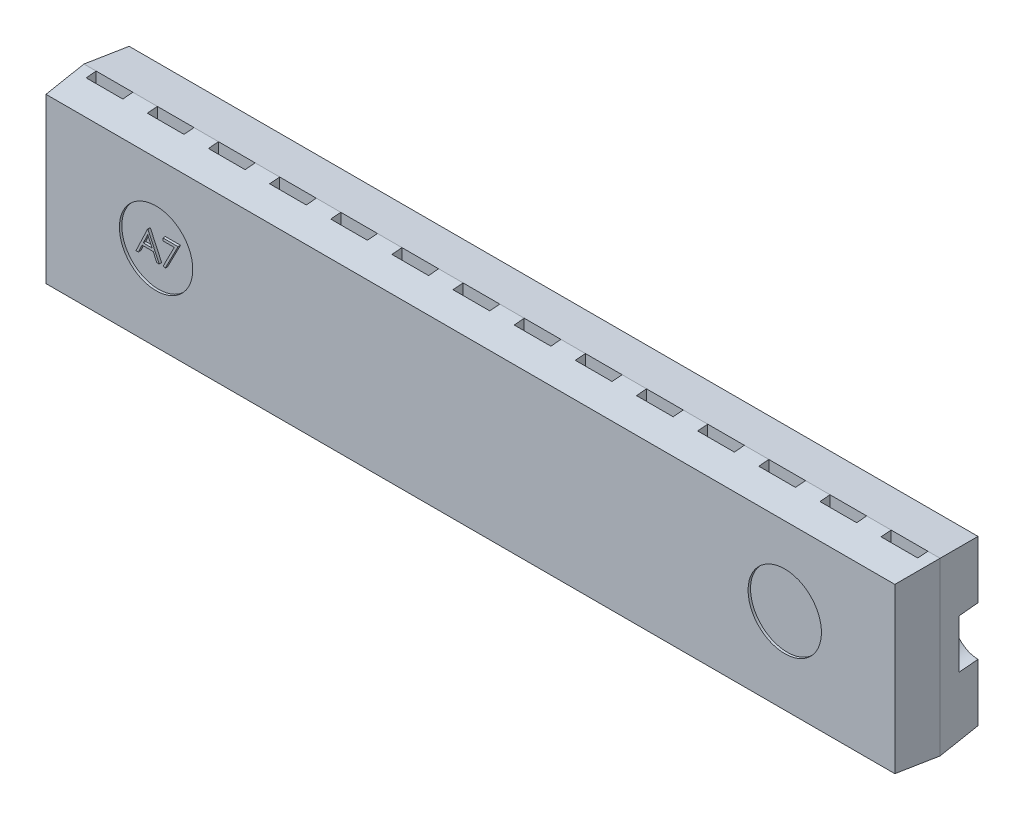
from build123d import *

# Parameters (mm, degrees)
SKETCH2_W                     = 35
SKETCH2_H                     = 7
BOSS_EXTRUDE1_DEPTH           = 1.7
BOSS_EXTRUDE1_TAPER           = 5
BOSS_EXTRUDE1_OTHER_WAY_DEPTH = 1.7
BOSS_EXTRUDE1_OTHER_WAY_TAPER = 5
SKETCH3_W                     = 1.5
SKETCH3_H                     = 0.41
CUT_EXTRUDE1_DEPTH            = 1.7
LPATTERN1_COUNT               = 14
LPATTERN1_PITCH               = 2.5
SKETCH6_W                     = 1.5
SKETCH6_H                     = 0.41
CUT_EXTRUDE2_DEPTH            = 1.7
LPATTERN2_COUNT               = 14
LPATTERN2_PITCH               = 2.5
SKETCH7_R                     = 1
SKETCH7_R_2                   = 0.5
CUT_EXTRUDE4_DEPTH            = 0.1
SKETCH8_R                     = 1
CUT_EXTRUDE6_DEPTH            = 0.85
SKETCH9_R                     = 1.5
CUT_EXTRUDE7_DEPTH            = 0.1
SKETCH10_W                    = 0.384615385
SKETCH10_H                    = 0.102564103
BOSS_EXTRUDE3_DEPTH           = 0.1
BOSS_EXTRUDE4_DEPTH           = 0.1
BOSS_EXTRUDE6_DEPTH           = 0.1


with BuildPart() as part:
    # Sketch2 → Boss-Extrude1 (new body)
    with BuildSketch(Plane.XY):
        with Locations((17.5, 3.5)):
            Rectangle(SKETCH2_W, SKETCH2_H)
    extrude(amount=BOSS_EXTRUDE1_DEPTH, taper=BOSS_EXTRUDE1_TAPER)

    # Sketch2 → Boss-Extrude1 other way (add)
    with BuildSketch(Plane.XY):
        with Locations((17.5, 3.5)):
            Rectangle(SKETCH2_W, SKETCH2_H)
    extrude(amount=-BOSS_EXTRUDE1_OTHER_WAY_DEPTH, taper=BOSS_EXTRUDE1_OTHER_WAY_TAPER)

    # Sketch3 → Cut-Extrude1 (cut)
    with BuildSketch(Plane(origin=(0, 0, 0), x_dir=(1, 0, 0), z_dir=(0, 1, 0))):
        with Locations((1.25, -0.205)):
            Rectangle(SKETCH3_W, SKETCH3_H)
    cut_extrude1 = extrude(amount=CUT_EXTRUDE1_DEPTH, mode=Mode.SUBTRACT)

    # LPattern1: Cut-Extrude1 ×14
    with Locations(*[(i * LPATTERN1_PITCH, 0, 0) for i in range(1, LPATTERN1_COUNT)]):
        add(cut_extrude1, mode=Mode.SUBTRACT)

    # Sketch6 → Cut-Extrude2 (cut)
    with BuildSketch(Plane(origin=(0, 7, 0), x_dir=(1, 0, 0), z_dir=(0, 1, 0))):
        with Locations((1.25, -0.205)):
            Rectangle(SKETCH6_W, SKETCH6_H)
    cut_extrude2 = extrude(amount=-CUT_EXTRUDE2_DEPTH, mode=Mode.SUBTRACT)

    # LPattern2: Cut-Extrude2 ×14
    with Locations(*[(i * LPATTERN2_PITCH, 0, 0) for i in range(1, LPATTERN2_COUNT)]):
        add(cut_extrude2, mode=Mode.SUBTRACT)

    # Sketch7 → Cut-Extrude4 (cut)
    with BuildSketch(Plane(origin=(0, 0, -1.7), x_dir=(-1, 0, 0), z_dir=(0, 0, -1))):
        with Locations((-30.351269272, 3.648730728)):
            Circle(SKETCH7_R)
        with Locations(Location((-4.648730728, 3.648730728, 0), (0, 0, 180))):
            Circle(SKETCH7_R)
        with Locations((-33.051269272, 1.648730728)):
            Circle(SKETCH7_R_2)
    extrude(amount=-CUT_EXTRUDE4_DEPTH, mode=Mode.SUBTRACT)

    # Sketch8 → Cut-Extrude6 (cut)
    with BuildSketch(Plane(origin=(0, 0, -1.7), x_dir=(-1, 0, 0), z_dir=(0, 0, -1))):
        with Locations((-34.851269272, 3.5)):
            Circle(SKETCH8_R)
    extrude(amount=-CUT_EXTRUDE6_DEPTH, mode=Mode.SUBTRACT)

    # Sketch9 → Cut-Extrude7 (cut)
    with BuildSketch(Plane.XY.offset(1.7)):
        with Locations((4.648730728, 3.648730728)):
            Circle(SKETCH9_R)
        with Locations(Location((30.351269272, 3.648730728, 0), (0, 0, 180))):
            Circle(SKETCH9_R)
    extrude(amount=-CUT_EXTRUDE7_DEPTH, mode=Mode.SUBTRACT)

    # Sketch10 → Boss-Extrude3 (add)
    # profile 1 of 18: a face of its own
    with BuildSketch(Plane(origin=(0, 0, -1.7), x_dir=(-1, 0, 0), z_dir=(0, 0, -1))):
        Polygon((-20.812807734, 4.351269272), (-20.351269272, 3.351269272), (-20.448825362, 3.351269272), (-20.5966619, 3.671782093), (-21.049987221, 3.671782093), (-21.20203049, 3.351269272), (-21.299987221, 3.351269272), (-20.825628246, 4.351269272), align=None)
        Polygon((-20.820219593, 4.156357413), (-21.001309336, 3.774346195), (-20.643937541, 3.774346195), align=None, mode=Mode.SUBTRACT)
    # profile 2 of 18: a face of its own
    with BuildSketch(Plane(origin=(0, 0, -1.7), x_dir=(-1, 0, 0), z_dir=(0, 0, -1))):
        Polygon((-20.287166708, 4.248705169), (-20.287166708, 4.351269272), (-19.761525682, 4.351269272), (-19.761525682, 4.248705169), (-19.9794744, 4.248705169), (-19.9794744, 3.351269272), (-20.06921799, 3.351269272), (-20.06921799, 4.248705169), align=None)
    # profile 3 of 18: a face of its own
    with BuildSketch(Plane(origin=(0, 0, -1.7), x_dir=(-1, 0, 0), z_dir=(0, 0, -1))):
        Polygon((-19.65896158, 3.351269272), (-19.526950362, 4.351269272), (-19.514129849, 4.351269272), (-19.101269272, 3.530756451), (-18.689410298, 4.351269272), (-18.676389464, 4.351269272), (-18.543576964, 3.351269272), (-18.633721195, 3.351269272), (-18.7294744, 4.070820554), (-19.090451964, 3.351269272), (-19.110684336, 3.351269272), (-19.473064144, 4.072423118), (-19.568617028, 3.351269272), align=None)
    # profile 4 of 18: a face of its own
    with BuildSketch(Plane(origin=(0, 0, -1.7), x_dir=(-1, 0, 0), z_dir=(0, 0, -1))):
        Polygon((-18.338448759, 4.351269272), (-17.774346195, 4.351269272), (-17.774346195, 4.248705169), (-18.248705169, 4.248705169), (-18.248705169, 3.941012862), (-17.774346195, 3.941012862), (-17.774346195, 3.838448759), (-18.248705169, 3.838448759), (-18.248705169, 3.453833375), (-17.774346195, 3.453833375), (-17.774346195, 3.351269272), (-18.338448759, 3.351269272), align=None)
    # profile 5 of 18: a face of its own
    with BuildSketch(Plane(origin=(0, 0, -1.7), x_dir=(-1, 0, 0), z_dir=(0, 0, -1))):
        Polygon((-17.594859016, 4.351269272), (-17.505115426, 4.351269272), (-17.505115426, 3.453833375), (-17.120500041, 3.453833375), (-17.120500041, 3.351269272), (-17.594859016, 3.351269272), align=None)
    # profile 6 of 18: a face of its own
    with BuildSketch(Plane(origin=(0, 0, -1.7), x_dir=(-1, 0, 0), z_dir=(0, 0, -1))):
        Polygon((-22.812807734, 2.648730728), (-22.351269272, 1.648730728), (-22.448825362, 1.648730728), (-22.5966619, 1.969243549), (-23.049987221, 1.969243549), (-23.20203049, 1.648730728), (-23.299987221, 1.648730728), (-22.825628246, 2.648730728), align=None)
        Polygon((-22.820219593, 2.453818869), (-23.001309336, 2.071807651), (-22.643937541, 2.071807651), align=None, mode=Mode.SUBTRACT)
    # profile 7 of 18: a face of its own
    with BuildSketch(Plane(origin=(0, 0, -1.7), x_dir=(-1, 0, 0), z_dir=(0, 0, -1))):
        Polygon((-22.287166708, 2.546166625), (-22.287166708, 2.648730728), (-21.761525682, 2.648730728), (-21.761525682, 2.546166625), (-21.9794744, 2.546166625), (-21.9794744, 1.648730728), (-22.06921799, 1.648730728), (-22.06921799, 2.546166625), align=None)
    # profile 8 of 18: a face of its own
    with BuildSketch(Plane(origin=(0, 0, -1.7), x_dir=(-1, 0, 0), z_dir=(0, 0, -1))):
        Polygon((-21.65896158, 1.648730728), (-21.526950362, 2.648730728), (-21.514129849, 2.648730728), (-21.101269272, 1.828217907), (-20.689410298, 2.648730728), (-20.676389464, 2.648730728), (-20.543576964, 1.648730728), (-20.633721195, 1.648730728), (-20.7294744, 2.36828201), (-21.090451964, 1.648730728), (-21.110684336, 1.648730728), (-21.473064144, 2.369884574), (-21.568617028, 1.648730728), align=None)
    # profile 9 of 18: a face of its own
    with BuildSketch(Plane(origin=(0, 0, -1.7), x_dir=(-1, 0, 0), z_dir=(0, 0, -1))):
        Polygon((-20.338448759, 2.648730728), (-19.774346195, 2.648730728), (-19.774346195, 2.546166625), (-20.248705169, 2.546166625), (-20.248705169, 2.238474318), (-19.774346195, 2.238474318), (-19.774346195, 2.135910215), (-20.248705169, 2.135910215), (-20.248705169, 1.751294831), (-19.774346195, 1.751294831), (-19.774346195, 1.648730728), (-20.338448759, 1.648730728), align=None)
    # profile 10 of 18: a face of its own
    with BuildSketch(Plane(origin=(0, 0, -1.7), x_dir=(-1, 0, 0), z_dir=(0, 0, -1))):
        with BuildLine():
            Line((-18.65896158, 2.478057651), (-18.735884657, 2.405140984))
            add(Edge.make_bspline(
                [(-18.735884657, 2.405140984), (-18.749804339, 2.418235517), (-18.777311781, 2.444112335), (-18.822157564, 2.477686905), (-18.868947174, 2.506448648), (-18.917436459, 2.529850429), (-18.966424617, 2.548522647), (-19.01526141, 2.561816401), (-19.063445897, 2.570294269), (-19.095493673, 2.571308089), (-19.111285298, 2.571807651)],
                knots=[0, 0, 0, 0, 1.08915593, 2.152340314, 3.188132944, 4.216796309, 5.218260357, 6.173443236, 7.099959455, 8, 8, 8, 8], degree=3))
            add(Edge.make_bspline(
                [(-19.111285298, 2.571807651), (-19.120975212, 2.571689478), (-19.140329909, 2.571453438), (-19.169079036, 2.568440805), (-19.197526647, 2.564107987), (-19.225619039, 2.557838879), (-19.253410836, 2.549893434), (-19.280805376, 2.53995473), (-19.307853763, 2.528367517), (-19.334301215, 2.514978239), (-19.359941359, 2.500269711), (-19.384157598, 2.483970128), (-19.407104283, 2.466601903), (-19.428350119, 2.447730194), (-19.448017315, 2.427525947), (-19.466573993, 2.406365002), (-19.483367506, 2.383669226), (-19.49853641, 2.35985619), (-19.512068301, 2.335344136), (-19.524013631, 2.310368996), (-19.53404137, 2.285013609), (-19.5419755, 2.259246158), (-19.548521401, 2.233265989), (-19.553126432, 2.206893212), (-19.555722638, 2.180099588), (-19.556171718, 2.162157514), (-19.556397477, 2.153137779)],
                knots=[0, 0, 0, 0, 1.02818874, 2.053710826, 3.065248034, 4.081641283, 5.106893873, 6.131558223, 7.173050175, 8.228653731, 9.27666206, 10.308777013, 11.325269123, 12.329503258, 13.32196095, 14.316845687, 15.314881793, 16.315733098, 17.311955233, 18.285320748, 19.252783886, 20.203351036, 21.145449891, 22.095197417, 23.042428769, 24, 24, 24, 24], degree=3))
            add(Edge.make_bspline(
                [(-19.556397477, 2.153137779), (-19.556181558, 2.143917546), (-19.555750308, 2.125502256), (-19.552990217, 2.098018235), (-19.547867863, 2.070942406), (-19.541019946, 2.044185797), (-19.532453998, 2.017702583), (-19.521776094, 1.99160758), (-19.509128779, 1.965901754), (-19.494489764, 1.940816721), (-19.478436563, 1.916381571), (-19.460452826, 1.893364565), (-19.441349802, 1.8714592), (-19.420431545, 1.851151839), (-19.398368819, 1.831899297), (-19.374502454, 1.814232005), (-19.349301751, 1.797809656), (-19.322728262, 1.782839222), (-19.295070324, 1.769465354), (-19.266711252, 1.757572813), (-19.237560447, 1.747778716), (-19.207771108, 1.739796401), (-19.177378744, 1.733253459), (-19.146229086, 1.729044179), (-19.11455117, 1.725989655), (-19.093197275, 1.725766321), (-19.082439144, 1.725653805)],
                knots=[0, 0, 0, 0, 0.93586088, 1.869166235, 2.799637598, 3.729985548, 4.670839027, 5.622275134, 6.589130586, 7.576015415, 8.568469353, 9.55398029, 10.53834874, 11.515998671, 12.510579167, 13.508179873, 14.527009472, 15.561807829, 16.601455013, 17.643573243, 18.680854198, 19.719860599, 20.772568776, 21.833555941, 22.908541556, 24, 24, 24, 24], degree=3))
            add(Edge.make_bspline(
                [(-19.082439144, 1.725653805), (-19.069473902, 1.725924827), (-19.044014543, 1.726457022), (-19.006589845, 1.730599962), (-18.97064611, 1.737070474), (-18.936284338, 1.746546445), (-18.903464618, 1.758633209), (-18.872066634, 1.77320332), (-18.842337589, 1.790815622), (-18.814188111, 1.81069387), (-18.788257486, 1.832840965), (-18.764870594, 1.856739381), (-18.744400454, 1.882273114), (-18.726541969, 1.909291775), (-18.711768067, 1.938019005), (-18.699641554, 1.968314023), (-18.690346328, 2.000190455), (-18.686530621, 2.022216636), (-18.684602605, 2.033346113)],
                knots=[0, 0, 0, 0, 1.13008108, 2.219097802, 3.278683437, 4.311054135, 5.322181354, 6.324827112, 7.324222904, 8.330512327, 9.32562643, 10.293043162, 11.24128371, 12.174520618, 13.111833804, 14.052305215, 15.015860969, 16, 16, 16, 16], degree=3))
            Line((-18.684602605, 2.033346113), (-19.017935939, 2.033346113))
            Line((-19.017935939, 2.033346113), (-19.017935939, 2.135910215))
            Line((-19.017935939, 2.135910215), (-18.594859016, 2.135910215))
            add(Edge.make_bspline(
                [(-18.594859016, 2.135910215), (-18.595346401, 2.11679379), (-18.596300302, 2.079379492), (-18.602991421, 2.024816558), (-18.613796138, 1.973281788), (-18.628556227, 1.92472091), (-18.64766345, 1.879202741), (-18.670912744, 1.836681065), (-18.698676207, 1.797430585), (-18.729964905, 1.76113087), (-18.765079179, 1.728751095), (-18.803070213, 1.700292255), (-18.844000775, 1.676320079), (-18.887832149, 1.656817033), (-18.934420844, 1.641595892), (-18.983874667, 1.630804013), (-19.036126553, 1.624338309), (-19.071937032, 1.6235122), (-19.090251644, 1.623089702)],
                knots=[0, 0, 0, 0, 1.140356446, 2.231883559, 3.274166699, 4.278491846, 5.25512956, 6.21435461, 7.1637429, 8.11826594, 9.068280886, 10.0076534, 10.945064095, 11.891975133, 12.864533718, 13.863980011, 14.907571808, 16, 16, 16, 16], degree=3))
            add(Edge.make_bspline(
                [(-19.090251644, 1.623089702), (-19.101540254, 1.623252308), (-19.123805031, 1.62357302), (-19.156688154, 1.625852262), (-19.188664617, 1.629360998), (-19.219729762, 1.634659605), (-19.24999786, 1.641149506), (-19.279317741, 1.649459997), (-19.307801096, 1.659079626), (-19.335491949, 1.670021247), (-19.362138962, 1.682698863), (-19.387860824, 1.696787331), (-19.412799718, 1.712214006), (-19.436785765, 1.729245676), (-19.459943942, 1.74775495), (-19.482124926, 1.767778927), (-19.503452891, 1.78925639), (-19.516813024, 1.804507535), (-19.523544913, 1.812192266)],
                knots=[0, 0, 0, 0, 1.107784379, 2.184907829, 3.233506516, 4.263428166, 5.276301166, 6.270063455, 7.25232949, 8.225834625, 9.190232166, 10.146266622, 11.1027726, 12.066435141, 13.031522626, 14.010570082, 14.99756817, 16, 16, 16, 16], degree=3))
            add(Edge.make_bspline(
                [(-19.523544913, 1.812192266), (-19.533312322, 1.824383882), (-19.552685011, 1.848564744), (-19.577621628, 1.887307585), (-19.598879171, 1.927422402), (-19.616127121, 1.969020867), (-19.629595145, 2.012064071), (-19.639254075, 2.056497011), (-19.6449133, 2.102376906), (-19.645728596, 2.133424124), (-19.646141067, 2.149131369)],
                knots=[0, 0, 0, 0, 1.023165419, 2.029347347, 3.013907458, 3.994755782, 4.975994455, 5.96558838, 6.970761222, 8, 8, 8, 8], degree=3))
            add(Edge.make_bspline(
                [(-19.646141067, 2.149131369), (-19.645988999, 2.160893156), (-19.645686795, 2.184267243), (-19.642022362, 2.218969331), (-19.636764814, 2.253055243), (-19.629037084, 2.286497116), (-19.619295294, 2.319317286), (-19.607137156, 2.351530989), (-19.592981471, 2.383157239), (-19.576528472, 2.413978344), (-19.558218627, 2.443585319), (-19.538347135, 2.471858977), (-19.516631821, 2.498284424), (-19.493427307, 2.523196323), (-19.468456738, 2.546281708), (-19.441954045, 2.567754311), (-19.413898805, 2.587642936), (-19.384202753, 2.605634317), (-19.353309129, 2.621795352), (-19.321291986, 2.635963698), (-19.288161097, 2.647673217), (-19.254164675, 2.657608582), (-19.219045389, 2.664955765), (-19.183058093, 2.670283978), (-19.146015203, 2.673929864), (-19.120976338, 2.67422308), (-19.10828049, 2.674371754)],
                knots=[0, 0, 0, 0, 1.008945113, 2.00506715, 2.99143336, 3.967273523, 4.948097931, 5.927297278, 6.919902385, 7.919676788, 8.923139349, 9.905703106, 10.883022732, 11.856032218, 12.825136022, 13.798837087, 14.781400844, 15.773989409, 16.776158564, 17.77167057, 18.775803737, 19.789618931, 20.80898985, 21.851988756, 22.910860228, 24, 24, 24, 24], degree=3))
            add(Edge.make_bspline(
                [(-19.10828049, 2.674371754), (-19.097926706, 2.674206185), (-19.077396369, 2.673877881), (-19.04684616, 2.671602267), (-19.016768156, 2.667995444), (-18.987117759, 2.663073505), (-18.95799594, 2.656369593), (-18.929319738, 2.648347226), (-18.901047585, 2.639006705), (-18.873268085, 2.627867035), (-18.845794452, 2.615223142), (-18.818473926, 2.600990736), (-18.791399856, 2.584926449), (-18.76452529, 2.566982581), (-18.737680759, 2.547467319), (-18.711290861, 2.525822512), (-18.684718591, 2.502901725), (-18.667632359, 2.486421101), (-18.65896158, 2.478057651)],
                knots=[0, 0, 0, 0, 0.985871117, 1.954866573, 2.915460327, 3.869826059, 4.81536089, 5.759505086, 6.70452669, 7.649098992, 8.607881297, 9.583363685, 10.581137262, 11.603961102, 12.659522466, 13.73993555, 14.853081303, 16, 16, 16, 16], degree=3))
        make_face()
    # profile 11 of 18: a face of its own
    with BuildSketch(Plane(origin=(0, 0, -1.7), x_dir=(-1, 0, 0), z_dir=(0, 0, -1))):
        Polygon((-17.9794744, 2.648730728), (-17.517935939, 1.648730728), (-17.615492028, 1.648730728), (-17.763328567, 1.969243549), (-18.216653887, 1.969243549), (-18.368697157, 1.648730728), (-18.466653887, 1.648730728), (-17.992294913, 2.648730728), align=None)
        Polygon((-17.986886259, 2.453818869), (-18.167976003, 2.071807651), (-17.810604208, 2.071807651), align=None, mode=Mode.SUBTRACT)
    # profile 12 of 18: a face of its own
    with BuildSketch(Plane(origin=(0, 0, -1.7), x_dir=(-1, 0, 0), z_dir=(0, 0, -1))):
        with BuildLine():
            Line((-17.299987221, 2.417961497), (-17.38973081, 2.417961497))
            add(Edge.make_bspline(
                [(-17.38973081, 2.417961497), (-17.38729951, 2.428027921), (-17.382546517, 2.447706957), (-17.372632925, 2.475823317), (-17.361833138, 2.502430037), (-17.348864822, 2.527028916), (-17.334719464, 2.550114316), (-17.318512972, 2.571162638), (-17.300993051, 2.590709199), (-17.281614494, 2.608055839), (-17.261292019, 2.623763761), (-17.239739271, 2.637156635), (-17.217389873, 2.648677821), (-17.194088978, 2.658169316), (-17.169767214, 2.665319466), (-17.144644465, 2.670507124), (-17.118654893, 2.673876014), (-17.101012725, 2.674204804), (-17.092054528, 2.674371754)],
                knots=[0, 0, 0, 0, 1.162005537, 2.271625781, 3.343758855, 4.383309926, 5.390229558, 6.379919256, 7.361854164, 8.333198761, 9.295911338, 10.242430842, 11.177959212, 12.116337295, 13.062827104, 14.020064771, 14.994644689, 16, 16, 16, 16], degree=3))
            add(Edge.make_bspline(
                [(-17.092054528, 2.674371754), (-17.079002316, 2.673977688), (-17.053182599, 2.673198152), (-17.0152503, 2.666079742), (-16.978671209, 2.654815418), (-16.943845709, 2.639251496), (-16.911497586, 2.620055121), (-16.882715818, 2.597208053), (-16.857890529, 2.57115111), (-16.837063564, 2.542370377), (-16.820756422, 2.51161166), (-16.808731743, 2.479954472), (-16.801411263, 2.447473909), (-16.800462533, 2.425543258), (-16.799987221, 2.414556049)],
                knots=[0, 0, 0, 0, 1.083050992, 2.142477498, 3.193116406, 4.255571735, 5.30263384, 6.308962982, 7.297363603, 8.282367274, 9.249857812, 10.179914175, 11.08814088, 12, 12, 12, 12], degree=3))
            add(Edge.make_bspline(
                [(-16.799987221, 2.414556049), (-16.800319675, 2.403982679), (-16.800970237, 2.383292234), (-16.806494153, 2.353086092), (-16.815790228, 2.324617064), (-16.828667303, 2.297765303), (-16.845336318, 2.272701063), (-16.865528517, 2.249367952), (-16.88938642, 2.227662478), (-16.907466117, 2.215228343), (-16.91677408, 2.208826882)],
                knots=[0, 0, 0, 0, 1.024540389, 2.004866551, 2.965041327, 3.920577974, 4.882998113, 5.874504559, 6.905732034, 8, 8, 8, 8], degree=3))
            add(Edge.make_bspline(
                [(-16.91677408, 2.208826882), (-16.906136436, 2.203690261), (-16.885060186, 2.193513131), (-16.856331463, 2.173554343), (-16.83025207, 2.150509672), (-16.81570815, 2.132526057), (-16.808400682, 2.123490343)],
                knots=[0, 0, 0, 0, 1.015518401, 2.012035669, 3.001164323, 4, 4, 4, 4], degree=3))
            add(Edge.make_bspline(
                [(-16.808400682, 2.123490343), (-16.80358887, 2.116902414), (-16.794044043, 2.103834438), (-16.782262462, 2.082824031), (-16.771574143, 2.061580748), (-16.763245509, 2.039535204), (-16.756795833, 2.016942914), (-16.752185538, 1.993765086), (-16.749321498, 1.969982794), (-16.74891134, 1.953893514), (-16.748705169, 1.945806049)],
                knots=[0, 0, 0, 0, 1.025084078, 2.033381695, 3.024893161, 4.013698104, 4.991890475, 5.976764909, 6.982997093, 8, 8, 8, 8], degree=3))
            add(Edge.make_bspline(
                [(-16.748705169, 1.945806049), (-16.749217888, 1.931803271), (-16.750240911, 1.903863613), (-16.759384932, 1.862585121), (-16.773560144, 1.822234978), (-16.793690697, 1.783642167), (-16.818224271, 1.747533486), (-16.847412078, 1.71522597), (-16.88092248, 1.68745494), (-16.918295523, 1.664252017), (-16.958786131, 1.64570404), (-17.002093443, 1.632830485), (-17.047593458, 1.624445913), (-17.078795543, 1.623546808), (-17.094658695, 1.623089702)],
                knots=[0, 0, 0, 0, 0.955779014, 1.907060117, 2.875433937, 3.871313158, 4.872415639, 5.851225146, 6.836215519, 7.83643374, 8.849228613, 9.86973379, 10.916971861, 12, 12, 12, 12], degree=3))
            add(Edge.make_bspline(
                [(-17.094658695, 1.623089702), (-17.105349924, 1.623337763), (-17.126386697, 1.623825864), (-17.15731341, 1.627162608), (-17.186833896, 1.633256895), (-17.214988067, 1.641457839), (-17.241800934, 1.65185548), (-17.267190679, 1.664803679), (-17.291313505, 1.680035537), (-17.313941777, 1.697730848), (-17.335072796, 1.717525516), (-17.354145003, 1.739770948), (-17.371476373, 1.76405592), (-17.386602841, 1.790662508), (-17.400213399, 1.819246867), (-17.411407958, 1.850175009), (-17.421260978, 1.883170444), (-17.425841967, 1.906164084), (-17.428192349, 1.917961497)],
                knots=[0, 0, 0, 0, 1.048658725, 2.063410685, 3.046034179, 4.001477787, 4.936774919, 5.862367409, 6.792675028, 7.730719943, 8.675894397, 9.627829632, 10.600096036, 11.597688215, 12.626045268, 13.701542398, 14.82072376, 16, 16, 16, 16], degree=3))
            Line((-17.428192349, 1.917961497), (-17.338448759, 1.917961497))
            add(Edge.make_bspline(
                [(-17.338448759, 1.917961497), (-17.336110676, 1.910261779), (-17.331562901, 1.895285159), (-17.323821673, 1.873730786), (-17.315002167, 1.853971342), (-17.305540864, 1.835861878), (-17.295604165, 1.819224049), (-17.284485615, 1.804497801), (-17.273008717, 1.791036315), (-17.264357473, 1.78345214), (-17.260123439, 1.779740343)],
                knots=[0, 0, 0, 0, 1.198163088, 2.33053128, 3.407730985, 4.417276592, 5.372219308, 6.28897303, 7.162600585, 8, 8, 8, 8], degree=3))
            add(Edge.make_bspline(
                [(-17.260123439, 1.779740343), (-17.254524417, 1.775423677), (-17.243343656, 1.766803667), (-17.225124161, 1.755803202), (-17.205962765, 1.746271481), (-17.185444287, 1.738990425), (-17.164011495, 1.732825379), (-17.141317963, 1.728790945), (-17.1175639, 1.726022896), (-17.10134454, 1.72577863), (-17.093056131, 1.725653805)],
                knots=[0, 0, 0, 0, 0.946170439, 1.889420265, 2.845303464, 3.807233317, 4.801018734, 5.828864929, 6.890507805, 8, 8, 8, 8], degree=3))
            add(Edge.make_bspline(
                [(-17.093056131, 1.725653805), (-17.083697987, 1.725829778), (-17.065398945, 1.726173878), (-17.038697557, 1.729338365), (-17.013295429, 1.733947055), (-16.989474593, 1.74106505), (-16.96692302, 1.749859579), (-16.945956834, 1.760901981), (-16.926300804, 1.773857615), (-16.908206688, 1.788583089), (-16.891936543, 1.804703516), (-16.877610968, 1.821564394), (-16.865432493, 1.839094631), (-16.855608613, 1.857391237), (-16.847851313, 1.876378445), (-16.842570399, 1.896109539), (-16.838898537, 1.916423044), (-16.838599505, 1.930231321), (-16.838448759, 1.937192266)],
                knots=[0, 0, 0, 0, 1.217147791, 2.380027433, 3.494444702, 4.572153297, 5.609568379, 6.639424714, 7.649109417, 8.668170816, 9.669597737, 10.625200337, 11.543417969, 12.441394052, 13.322311151, 14.205496177, 15.095365482, 16, 16, 16, 16], degree=3))
            add(Edge.make_bspline(
                [(-16.838448759, 1.937192266), (-16.838885988, 1.946509792), (-16.839758271, 1.96509848), (-16.846417865, 1.992446358), (-16.857371826, 2.018795905), (-16.872706829, 2.043697559), (-16.89137418, 2.066776388), (-16.913192725, 2.08736824), (-16.938343647, 2.104359695), (-16.961492181, 2.116099311), (-16.981996512, 2.124109904), (-16.999543765, 2.129445608), (-17.019188508, 2.133963795), (-17.040693179, 2.138167301), (-17.064219813, 2.141744829), (-17.089742795, 2.144728205), (-17.117267298, 2.14711536), (-17.136321917, 2.148181387), (-17.146141067, 2.148730728)],
                knots=[0, 0, 0, 0, 1.07054697, 2.135767047, 3.216561865, 4.33974944, 5.486079747, 6.621378074, 7.775625952, 8.963672916, 9.598146892, 10.304877434, 11.070270905, 11.915000392, 12.823868403, 13.805723172, 14.86925407, 16, 16, 16, 16], degree=3))
            Line((-17.146141067, 2.148730728), (-17.146141067, 2.251294831))
            add(Edge.make_bspline(
                [(-17.146141067, 2.251294831), (-17.133769305, 2.251504774), (-17.109536063, 2.251916003), (-17.074137691, 2.25688972), (-17.040288173, 2.2637699), (-17.008737675, 2.274308526), (-16.9799809, 2.286548611), (-16.955032442, 2.300792099), (-16.934241829, 2.316624885), (-16.917710094, 2.334291345), (-16.905273171, 2.353238501), (-16.896179801, 2.372986118), (-16.890808279, 2.393707278), (-16.890091231, 2.407848612), (-16.88973081, 2.41495669)],
                knots=[0, 0, 0, 0, 1.321986639, 2.589447074, 3.816329219, 5.01088745, 6.139805852, 7.153945165, 8.075214402, 8.924034688, 9.728124013, 10.488707548, 11.240355623, 12, 12, 12, 12], degree=3))
            add(Edge.make_bspline(
                [(-16.88973081, 2.41495669), (-16.889849214, 2.420178902), (-16.890084771, 2.430568247), (-16.893055422, 2.445746838), (-16.897519434, 2.460461394), (-16.903656499, 2.47464934), (-16.911870842, 2.488212276), (-16.921701123, 2.501265832), (-16.933406295, 2.513735484), (-16.94681928, 2.525358432), (-16.961222653, 2.536435357), (-16.977008303, 2.545839253), (-16.993700267, 2.553880699), (-17.011317025, 2.560511986), (-17.029915748, 2.565500354), (-17.04940905, 2.569082023), (-17.069834103, 2.571321353), (-17.083768883, 2.571643757), (-17.090852605, 2.571807651)],
                knots=[0, 0, 0, 0, 0.884392785, 1.759457502, 2.611959086, 3.489218968, 4.37281399, 5.2945488, 6.255912374, 7.266815255, 8.301784654, 9.332968512, 10.37626691, 11.440494194, 12.520033166, 13.637162961, 14.798855837, 16, 16, 16, 16], degree=3))
            add(Edge.make_bspline(
                [(-17.090852605, 2.571807651), (-17.102238796, 2.571410119), (-17.124478675, 2.570633647), (-17.15654008, 2.563832786), (-17.186345604, 2.552981905), (-17.20912808, 2.540029613), (-17.225951673, 2.527243775), (-17.237973655, 2.516077379), (-17.249779515, 2.503668001), (-17.260592566, 2.489251322), (-17.271527988, 2.473803668), (-17.281483577, 2.456539759), (-17.291157774, 2.437909932), (-17.296987074, 2.424739751), (-17.299987221, 2.417961497)],
                knots=[0, 0, 0, 0, 1.472543308, 2.876219568, 4.221790263, 5.565193594, 6.249813518, 6.953379497, 7.687249741, 8.463570142, 9.283606569, 10.136032583, 11.040678096, 12, 12, 12, 12], degree=3))
        make_face()
    # profile 13 of 18: a face of its own
    with BuildSketch(Plane(origin=(0, 0, -1.7), x_dir=(-1, 0, 0), z_dir=(0, 0, -1))):
        with BuildLine():
            Line((-16.530756451, 2.34103842), (-16.620500041, 2.34103842))
            add(Edge.make_bspline(
                [(-16.620500041, 2.34103842), (-16.61991514, 2.352944388), (-16.618766411, 2.376327392), (-16.613386899, 2.410419937), (-16.605689506, 2.443007022), (-16.594806233, 2.473826998), (-16.581290154, 2.503152371), (-16.565081575, 2.530866662), (-16.545883332, 2.556864144), (-16.524109979, 2.580903814), (-16.500461797, 2.602957405), (-16.474945814, 2.62200176), (-16.448132949, 2.638092524), (-16.420104549, 2.651544307), (-16.390544388, 2.661641406), (-16.359720715, 2.669133303), (-16.327498104, 2.67364083), (-16.305543812, 2.67412534), (-16.294378246, 2.674371754)],
                knots=[0, 0, 0, 0, 1.10065271, 2.161652631, 3.183658789, 4.190468796, 5.17591951, 6.163126047, 7.15150782, 8.156236427, 9.156009102, 10.134482811, 11.092018607, 12.041330605, 13.001268258, 13.972401359, 14.968799086, 16, 16, 16, 16], degree=3))
            add(Edge.make_bspline(
                [(-16.294378246, 2.674371754), (-16.283413082, 2.674115052), (-16.261866927, 2.673610642), (-16.230420637, 2.669278919), (-16.200484267, 2.662494464), (-16.172116334, 2.652975774), (-16.145543172, 2.640180223), (-16.12056516, 2.624809498), (-16.096884928, 2.607032403), (-16.075568704, 2.586102742), (-16.055994967, 2.563759204), (-16.039108609, 2.539905517), (-16.024647705, 2.515268578), (-16.012594082, 2.489660521), (-16.003720899, 2.462840227), (-15.996984269, 2.435198169), (-15.993176436, 2.406448223), (-15.992592029, 2.386989207), (-15.992294913, 2.377096113)],
                knots=[0, 0, 0, 0, 1.111607364, 2.184268762, 3.212621178, 4.221274766, 5.211760367, 6.196651075, 7.1921475, 8.207485113, 9.220403448, 10.201281604, 11.166441695, 12.114753415, 13.065576456, 14.026450734, 14.996634279, 16, 16, 16, 16], degree=3))
            add(Edge.make_bspline(
                [(-15.992294913, 2.377096113), (-15.992778702, 2.36316816), (-15.993737791, 2.33555667), (-16.001941899, 2.294980995), (-16.014755188, 2.25566859), (-16.030183004, 2.224029361), (-16.04574656, 2.198534077), (-16.059771562, 2.177543018), (-16.076190079, 2.154941456), (-16.095241079, 2.130805074), (-16.116530471, 2.104944815), (-16.140251089, 2.077376302), (-16.166572084, 2.048384368), (-16.185045941, 2.028582767), (-16.194618631, 2.018322074)],
                knots=[0, 0, 0, 0, 1.184426356, 2.348067706, 3.509069118, 4.696110526, 5.333549288, 6.050745305, 6.844228056, 7.710549037, 8.667450064, 9.695053472, 10.805634456, 12, 12, 12, 12], degree=3))
            Line((-16.194618631, 2.018322074), (-16.444818951, 1.751294831))
            Line((-16.444818951, 1.751294831), (-15.9794744, 1.751294831))
            Line((-15.9794744, 1.751294831), (-15.9794744, 1.648730728))
            Line((-15.9794744, 1.648730728), (-16.65896158, 1.648730728))
            Line((-16.65896158, 1.648730728), (-16.271141067, 2.062592907))
            add(Edge.make_bspline(
                [(-16.271141067, 2.062592907), (-16.261698814, 2.072449566), (-16.243562177, 2.091382191), (-16.217910012, 2.119023037), (-16.194870301, 2.144665763), (-16.174293904, 2.16826192), (-16.156627188, 2.190156653), (-16.140949407, 2.209640854), (-16.12838781, 2.227570697), (-16.11475484, 2.24835373), (-16.101550845, 2.273728678), (-16.090204457, 2.304738303), (-16.083285929, 2.336660375), (-16.082455976, 2.358232386), (-16.082038503, 2.369083292)],
                knots=[0, 0, 0, 0, 1.329631726, 2.553950428, 3.673215718, 4.687767853, 5.603093632, 6.413772471, 7.123043292, 7.734684054, 8.834405432, 9.900288307, 10.943827018, 12, 12, 12, 12], degree=3))
            add(Edge.make_bspline(
                [(-16.082038503, 2.369083292), (-16.082220143, 2.375906549), (-16.082578122, 2.389353877), (-16.085737464, 2.409069809), (-16.090511895, 2.428088327), (-16.097353397, 2.446467932), (-16.106383894, 2.464023833), (-16.117376288, 2.480777399), (-16.130059164, 2.496974246), (-16.144730955, 2.512160902), (-16.160848532, 2.526069818), (-16.177875461, 2.538390986), (-16.195889776, 2.548687874), (-16.214815525, 2.557128874), (-16.234599945, 2.563750411), (-16.255281301, 2.568338577), (-16.276802448, 2.571219286), (-16.291497733, 2.57160905), (-16.298985618, 2.571807651)],
                knots=[0, 0, 0, 0, 0.991446411, 1.95395049, 2.89581595, 3.838931463, 4.798493298, 5.75982156, 6.748411868, 7.785213223, 8.824556874, 9.840280684, 10.836137867, 11.835679398, 12.848801643, 13.863922112, 14.911575587, 16, 16, 16, 16], degree=3))
            add(Edge.make_bspline(
                [(-16.298985618, 2.571807651), (-16.306805856, 2.571603356), (-16.322163512, 2.571202155), (-16.344711807, 2.568395679), (-16.366222029, 2.563554011), (-16.386748287, 2.556932104), (-16.406325312, 2.548515375), (-16.424857896, 2.53803202), (-16.442304436, 2.52552245), (-16.458697728, 2.511339434), (-16.473801722, 2.495548691), (-16.487072258, 2.477945844), (-16.498667691, 2.458852297), (-16.508784615, 2.438319568), (-16.517000526, 2.416161345), (-16.523278569, 2.392456287), (-16.528246239, 2.367307321), (-16.529905817, 2.349940154), (-16.530756451, 2.34103842)],
                knots=[0, 0, 0, 0, 1.031018746, 2.02475058, 2.990194455, 3.934040569, 4.864654155, 5.795059489, 6.735614925, 7.690564532, 8.649604399, 9.611025574, 10.590972636, 11.591080095, 12.624614302, 13.701020113, 14.821632451, 16, 16, 16, 16], degree=3))
        make_face()
    # profile 14 of 18: a face of its own
    with BuildSketch(Plane(origin=(0, 0, -1.7), x_dir=(-1, 0, 0), z_dir=(0, 0, -1))):
        with BuildLine():
            add(Edge.make_bspline(
                [(-15.403552926, 2.205822074), (-15.395367627, 2.201554087), (-15.37940356, 2.193230086), (-15.356667214, 2.179826992), (-15.335888643, 2.165701002), (-15.316491339, 2.151519328), (-15.298816096, 2.136738856), (-15.28306055, 2.121300812), (-15.268835515, 2.105590542), (-15.256427863, 2.089342016), (-15.245514481, 2.072598402), (-15.236082442, 2.055315752), (-15.228020384, 2.037531943), (-15.221630973, 2.019052849), (-15.216367604, 2.000149917), (-15.212746003, 1.980579065), (-15.210798312, 1.960469253), (-15.21043008, 1.94687831), (-15.210243631, 1.939996754)],
                knots=[0, 0, 0, 0, 1.272397273, 2.481599622, 3.635517121, 4.734568067, 5.792894095, 6.808321871, 7.773003508, 8.711915296, 9.623354172, 10.525449501, 11.423591555, 12.311487226, 13.218079475, 14.126165749, 15.051214107, 16, 16, 16, 16], degree=3))
            add(Edge.make_bspline(
                [(-15.210243631, 1.939996754), (-15.210464037, 1.93036883), (-15.210900303, 1.911311557), (-15.214700298, 1.883184096), (-15.220389721, 1.855866444), (-15.228698153, 1.82936459), (-15.239473407, 1.803824769), (-15.252752503, 1.779225119), (-15.267784276, 1.755162459), (-15.279856344, 1.740356916), (-15.285964785, 1.732865343)],
                knots=[0, 0, 0, 0, 1.025265484, 2.029385089, 3.018602448, 3.995076438, 4.983346944, 5.966715145, 6.97116228, 8, 8, 8, 8], degree=3))
            add(Edge.make_bspline(
                [(-15.285964785, 1.732865343), (-15.293918063, 1.724124265), (-15.309726339, 1.706750124), (-15.336807176, 1.68419275), (-15.366527714, 1.66523578), (-15.398772952, 1.649786668), (-15.433456695, 1.637762136), (-15.470571553, 1.629121417), (-15.510189883, 1.624172152), (-15.537420017, 1.623456726), (-15.551389464, 1.623089702)],
                knots=[0, 0, 0, 0, 0.954267603, 1.896743057, 2.838368354, 3.796610408, 4.779680527, 5.799409237, 6.871065594, 8, 8, 8, 8], degree=3))
            add(Edge.make_bspline(
                [(-15.551389464, 1.623089702), (-15.564821861, 1.623418982), (-15.590959941, 1.624059726), (-15.629005049, 1.628400992), (-15.664468783, 1.636008954), (-15.697557345, 1.6464217), (-15.728071258, 1.659967479), (-15.755923572, 1.676827025), (-15.781516136, 1.696321722), (-15.804072271, 1.719011459), (-15.824097541, 1.743313708), (-15.841688413, 1.768385597), (-15.856309578, 1.794229413), (-15.868688748, 1.820459804), (-15.878165326, 1.847444419), (-15.884728815, 1.875044423), (-15.88889719, 1.903211607), (-15.8894518, 1.92222065), (-15.88973081, 1.931783613)],
                knots=[0, 0, 0, 0, 1.256902934, 2.445805442, 3.576955095, 4.645999104, 5.686449165, 6.692658513, 7.68621702, 8.689161843, 9.678783111, 10.630372946, 11.551080876, 12.453998257, 13.34127905, 14.221779781, 15.105423033, 16, 16, 16, 16], degree=3))
            add(Edge.make_bspline(
                [(-15.88973081, 1.931783613), (-15.889565702, 1.938800525), (-15.889239388, 1.952668419), (-15.88698086, 1.973156799), (-15.883349871, 1.993098552), (-15.878418598, 2.012567336), (-15.871735447, 2.031421414), (-15.863666267, 2.04975012), (-15.854257137, 2.067574149), (-15.843376804, 2.084990972), (-15.830719083, 2.101756547), (-15.816386612, 2.118155402), (-15.800092935, 2.133933079), (-15.782019318, 2.149282343), (-15.762372307, 2.164475478), (-15.740641584, 2.178691401), (-15.717403222, 2.192936533), (-15.700887392, 2.201453198), (-15.692415105, 2.205822074)],
                knots=[0, 0, 0, 0, 0.941657376, 1.861047343, 2.762797495, 3.66048619, 4.553285746, 5.444104102, 6.34607688, 7.256116206, 8.197091036, 9.162375105, 10.176350973, 11.237807142, 12.343728897, 13.50695164, 14.721116704, 16, 16, 16, 16], degree=3))
            add(Edge.make_bspline(
                [(-15.692415105, 2.205822074), (-15.704012641, 2.212146294), (-15.726468716, 2.224391753), (-15.756202842, 2.246890841), (-15.78174302, 2.271258788), (-15.802387225, 2.298010158), (-15.818636433, 2.326309264), (-15.829784606, 2.355979051), (-15.837326459, 2.386469369), (-15.838073552, 2.407299711), (-15.838448759, 2.417761177)],
                knots=[0, 0, 0, 0, 1.166880483, 2.259407225, 3.286803203, 4.280235371, 5.237608625, 6.161067461, 7.076446754, 8, 8, 8, 8], degree=3))
            add(Edge.make_bspline(
                [(-15.838448759, 2.417761177), (-15.837981495, 2.428417622), (-15.837042213, 2.449838935), (-15.829446979, 2.481726399), (-15.817069817, 2.513045418), (-15.800235246, 2.543644193), (-15.77926747, 2.572487111), (-15.754111314, 2.598355953), (-15.725367515, 2.621016377), (-15.693179553, 2.64003814), (-15.658540629, 2.655519186), (-15.621993279, 2.666198735), (-15.584174281, 2.673180483), (-15.558432075, 2.673970955), (-15.545379849, 2.674371754)],
                knots=[0, 0, 0, 0, 0.888701115, 1.786444228, 2.72001202, 3.692817113, 4.693886446, 5.687152267, 6.695133018, 7.739871481, 8.800368666, 9.853104506, 10.91144658, 12, 12, 12, 12], degree=3))
            add(Edge.make_bspline(
                [(-15.545379849, 2.674371754), (-15.532664473, 2.673958513), (-15.507591201, 2.673143649), (-15.470735593, 2.666347398), (-15.435471342, 2.654996107), (-15.401920057, 2.6395969), (-15.37068238, 2.620629203), (-15.343081721, 2.597657524), (-15.318700983, 2.571902795), (-15.298534013, 2.543068623), (-15.281916045, 2.512587425), (-15.270344359, 2.480695276), (-15.262929509, 2.448081259), (-15.261994262, 2.426013258), (-15.261525682, 2.41495669)],
                knots=[0, 0, 0, 0, 1.072916533, 2.115669174, 3.151510826, 4.193348718, 5.225979165, 6.227137561, 7.216255879, 8.211077061, 9.189680878, 10.138522389, 11.067357538, 12, 12, 12, 12], degree=3))
            add(Edge.make_bspline(
                [(-15.261525682, 2.41495669), (-15.261935557, 2.404106214), (-15.262740527, 2.382796497), (-15.269511938, 2.351731777), (-15.280915742, 2.322639766), (-15.296485503, 2.295190351), (-15.316778499, 2.269881352), (-15.341523852, 2.246390932), (-15.370524274, 2.224526124), (-15.392313099, 2.212187162), (-15.403552926, 2.205822074)],
                knots=[0, 0, 0, 0, 0.975232327, 1.915300861, 2.843280834, 3.77672583, 4.742871857, 5.749627742, 6.839139064, 8, 8, 8, 8], degree=3))
        make_face()
        with BuildLine():
            add(Edge.make_bspline(
                [(-15.550387862, 2.571807651), (-15.557402378, 2.571621525), (-15.571125838, 2.571257382), (-15.591248316, 2.569354914), (-15.610383278, 2.565653995), (-15.628730649, 2.560728649), (-15.646038881, 2.554074938), (-15.66254304, 2.546247792), (-15.677962237, 2.536731774), (-15.692482609, 2.526057146), (-15.705554259, 2.514316315), (-15.717155559, 2.502083824), (-15.726792163, 2.489119426), (-15.734975338, 2.475745609), (-15.740912914, 2.461565445), (-15.745359858, 2.44701368), (-15.74836597, 2.431906427), (-15.748591224, 2.42158171), (-15.748705169, 2.416358933)],
                knots=[0, 0, 0, 0, 1.203892937, 2.355340988, 3.463153438, 4.544400666, 5.610487187, 6.640501085, 7.674077295, 8.714426146, 9.728707835, 10.68524104, 11.601827946, 12.495867327, 13.368432065, 14.231010473, 15.105153427, 16, 16, 16, 16], degree=3))
            add(Edge.make_bspline(
                [(-15.748705169, 2.416358933), (-15.748508779, 2.41113593), (-15.748120683, 2.400814527), (-15.745119218, 2.385572851), (-15.740645831, 2.37059524), (-15.733602785, 2.356237837), (-15.725155254, 2.342002592), (-15.714729118, 2.328245281), (-15.702303681, 2.314918028), (-15.688295841, 2.302134188), (-15.673035402, 2.290163113), (-15.656868532, 2.279770775), (-15.639998135, 2.271075315), (-15.622597543, 2.263838342), (-15.604489416, 2.258212646), (-15.585784709, 2.254221604), (-15.56648028, 2.251741034), (-15.553400114, 2.251444742), (-15.546782093, 2.251294831)],
                knots=[0, 0, 0, 0, 0.873023192, 1.725219244, 2.590779336, 3.480155217, 4.391973325, 5.357036234, 6.360879153, 7.436073238, 8.526419356, 9.601555421, 10.645666583, 11.697338044, 12.750135903, 13.812665442, 14.89329948, 16, 16, 16, 16], degree=3))
            add(Edge.make_bspline(
                [(-15.546782093, 2.251294831), (-15.538282063, 2.251544221), (-15.521365958, 2.252040539), (-15.496429006, 2.25665516), (-15.472182536, 2.263913994), (-15.448885706, 2.273845413), (-15.427141539, 2.286310516), (-15.407758662, 2.301234235), (-15.390902407, 2.318271977), (-15.376747947, 2.337158502), (-15.365773705, 2.357258955), (-15.357230332, 2.377430468), (-15.352241413, 2.397888248), (-15.35159068, 2.411593095), (-15.351269272, 2.418362138)],
                knots=[0, 0, 0, 0, 1.076279235, 2.141928126, 3.20205304, 4.278698113, 5.344010996, 6.36967002, 7.368914609, 8.37248503, 9.349703398, 10.264243087, 11.142681841, 12, 12, 12, 12], degree=3))
            add(Edge.make_bspline(
                [(-15.351269272, 2.418362138), (-15.351421243, 2.423113006), (-15.351722883, 2.432542796), (-15.354208613, 2.446468044), (-15.358315994, 2.460076496), (-15.363876874, 2.473480574), (-15.371193958, 2.486492211), (-15.37986944, 2.499315951), (-15.390407869, 2.511663312), (-15.402235422, 2.52382204), (-15.415648396, 2.535074618), (-15.430620942, 2.54497025), (-15.447076299, 2.55337378), (-15.465014856, 2.560199139), (-15.484370549, 2.565325524), (-15.505054227, 2.569164481), (-15.527238355, 2.571328227), (-15.542503998, 2.571644377), (-15.550387862, 2.571807651)],
                knots=[0, 0, 0, 0, 0.814439003, 1.616544685, 2.417341072, 3.248991801, 4.09997495, 4.973547432, 5.9003056, 6.880240646, 7.880314356, 8.896779544, 9.951930927, 11.043077905, 12.18215768, 13.381699519, 14.647792085, 16, 16, 16, 16], degree=3))
        make_face(mode=Mode.SUBTRACT)
        with BuildLine():
            add(Edge.make_bspline(
                [(-15.544578567, 2.148730728), (-15.553471648, 2.148572545), (-15.570917705, 2.148262228), (-15.596476827, 2.144808085), (-15.621006303, 2.139999687), (-15.644423427, 2.132705162), (-15.666718312, 2.12322045), (-15.68801165, 2.111810581), (-15.708140544, 2.098323312), (-15.726827038, 2.082929993), (-15.743890846, 2.066341578), (-15.758861789, 2.048780968), (-15.771575366, 2.03057453), (-15.781813438, 2.011491036), (-15.79021679, 1.991934576), (-15.79573504, 1.97141812), (-15.799272672, 1.950336087), (-15.79974771, 1.936004631), (-15.799987221, 1.928778805)],
                knots=[0, 0, 0, 0, 1.140299081, 2.23698856, 3.303958914, 4.344563908, 5.37730929, 6.408454204, 7.439741482, 8.480804886, 9.510774543, 10.48932336, 11.43758569, 12.353841022, 13.263987381, 14.161954604, 15.073269652, 16, 16, 16, 16], degree=3))
            add(Edge.make_bspline(
                [(-15.799987221, 1.928778805), (-15.799597718, 1.919798546), (-15.798824954, 1.901981922), (-15.792694486, 1.875649616), (-15.782855762, 1.850157886), (-15.769134271, 1.825714471), (-15.752143536, 1.802871584), (-15.73125026, 1.782960505), (-15.707752878, 1.765268654), (-15.680856348, 1.75095993), (-15.651476786, 1.739532829), (-15.619622006, 1.731659696), (-15.585749173, 1.726447854), (-15.562360718, 1.725922659), (-15.550387862, 1.725653805)],
                knots=[0, 0, 0, 0, 0.898778495, 1.783155532, 2.693654817, 3.627872908, 4.583023416, 5.533784346, 6.509005473, 7.520592997, 8.575161974, 9.658835044, 10.801527049, 12, 12, 12, 12], degree=3))
            add(Edge.make_bspline(
                [(-15.550387862, 1.725653805), (-15.541030614, 1.725833464), (-15.522799694, 1.726183499), (-15.496203709, 1.729273297), (-15.471105266, 1.73417319), (-15.447553038, 1.741299917), (-15.42528337, 1.749999911), (-15.40467384, 1.761191934), (-15.385194261, 1.773921169), (-15.367804511, 1.7890235), (-15.351966452, 1.805160498), (-15.33815694, 1.822243368), (-15.326169068, 1.839807834), (-15.316760223, 1.85825083), (-15.309238436, 1.877218519), (-15.303831707, 1.896885808), (-15.300495645, 1.917313018), (-15.300158246, 1.931169895), (-15.299987221, 1.938193869)],
                knots=[0, 0, 0, 0, 1.224942928, 2.386581632, 3.501229538, 4.569074225, 5.605009692, 6.626002462, 7.634866581, 8.645888296, 9.63523824, 10.59253846, 11.518950513, 12.414518923, 13.29783783, 14.186679152, 15.080837789, 16, 16, 16, 16], degree=3))
            add(Edge.make_bspline(
                [(-15.299987221, 1.938193869), (-15.300246035, 1.945015966), (-15.30075637, 1.958467951), (-15.303995425, 1.978401244), (-15.309685676, 1.997659191), (-15.317493503, 2.016473478), (-15.327888064, 2.034462893), (-15.340129455, 2.052096084), (-15.354899204, 2.06888364), (-15.371588517, 2.084955953), (-15.389776791, 2.099817592), (-15.409110261, 2.112964575), (-15.429440108, 2.124036608), (-15.450723311, 2.133041321), (-15.472912612, 2.140123455), (-15.495991692, 2.145070882), (-15.51998757, 2.148185055), (-15.536288962, 2.148546782), (-15.544578567, 2.148730728)],
                knots=[0, 0, 0, 0, 0.917430815, 1.809013306, 2.70690318, 3.612392954, 4.541220862, 5.495268465, 6.494511384, 7.542276156, 8.608045339, 9.649016899, 10.681629292, 11.715607085, 12.752076957, 13.808767841, 14.885711793, 16, 16, 16, 16], degree=3))
        make_face(mode=Mode.SUBTRACT)
    # profile 15 of 18: a face of its own
    with BuildSketch(Plane(origin=(0, 0, -1.7), x_dir=(-1, 0, 0), z_dir=(0, 0, -1))):
        with BuildLine():
            Line((-15.030756451, 2.648730728), (-14.834642669, 2.648730728))
            add(Edge.make_bspline(
                [(-14.834642669, 2.648730728), (-14.821153839, 2.6487159), (-14.795308641, 2.64868749), (-14.758247197, 2.647826134), (-14.724587273, 2.646675651), (-14.69440145, 2.645080824), (-14.667596851, 2.643196084), (-14.644294765, 2.640552644), (-14.624312035, 2.63779256), (-14.612338764, 2.634986444), (-14.606878246, 2.63370669)],
                knots=[0, 0, 0, 0, 1.415646017, 2.712440637, 3.8905458, 4.950247383, 5.884950622, 6.709939814, 7.411656543, 8, 8, 8, 8], degree=3))
            add(Edge.make_bspline(
                [(-14.606878246, 2.63370669), (-14.599965808, 2.631814704), (-14.586303815, 2.628075315), (-14.566617802, 2.62058568), (-14.547888132, 2.611705061), (-14.530050544, 2.601583935), (-14.513324235, 2.58978806), (-14.497459651, 2.576795598), (-14.4825968, 2.562306578), (-14.468819259, 2.546483509), (-14.45616646, 2.529592021), (-14.445272265, 2.511379955), (-14.4361502, 2.492153869), (-14.428326408, 2.471927134), (-14.422695421, 2.450529899), (-14.41845345, 2.428110838), (-14.415760985, 2.404672355), (-14.41550311, 2.38865525), (-14.415371836, 2.380501561)],
                knots=[0, 0, 0, 0, 0.999701418, 1.975846123, 2.934577507, 3.890451536, 4.834027766, 5.787354733, 6.749476667, 7.726910423, 8.712836071, 9.690891519, 10.682875813, 11.679750201, 12.712814741, 13.765529915, 14.8625177, 16, 16, 16, 16], degree=3))
            add(Edge.make_bspline(
                [(-14.415371836, 2.380501561), (-14.415492243, 2.372279339), (-14.415727828, 2.356192007), (-14.418555338, 2.332656924), (-14.422363964, 2.310165956), (-14.428220265, 2.28876897), (-14.435890457, 2.268593036), (-14.444888186, 2.249329826), (-14.455740624, 2.231307063), (-14.468210575, 2.214459315), (-14.482082459, 2.198770769), (-14.497297584, 2.184355113), (-14.513794525, 2.171296731), (-14.531520853, 2.159566347), (-14.550649381, 2.149435981), (-14.570889997, 2.140362466), (-14.59241863, 2.132742163), (-14.607316491, 2.128733574), (-14.614891067, 2.126695472)],
                knots=[0, 0, 0, 0, 1.121902311, 2.195077645, 3.232258892, 4.234102512, 5.217864754, 6.176164875, 7.132989551, 8.084763148, 9.034132444, 9.988522005, 10.94243251, 11.903244335, 12.886203696, 13.894208494, 14.929344452, 16, 16, 16, 16], degree=3))
            add(Edge.make_bspline(
                [(-14.614891067, 2.126695472), (-14.621156019, 2.125363191), (-14.634886027, 2.122443422), (-14.657498234, 2.119183862), (-14.683825487, 2.116401691), (-14.713831852, 2.114315651), (-14.747490397, 2.112529832), (-14.784819327, 2.111110377), (-14.825891921, 2.110330418), (-14.854540848, 2.110290192), (-14.869498439, 2.11026919)],
                knots=[0, 0, 0, 0, 0.601384939, 1.31797006, 2.144135048, 3.087295005, 4.142315834, 5.309527816, 6.595305764, 8, 8, 8, 8], degree=3))
            Line((-14.869498439, 2.11026919), (-14.941012862, 2.11026919))
            Line((-14.941012862, 2.11026919), (-14.941012862, 1.648730728))
            Line((-14.941012862, 1.648730728), (-15.030756451, 1.648730728))
            Line((-15.030756451, 1.648730728), (-15.030756451, 2.648730728))
        make_face()
        with BuildLine():
            Line((-14.941012862, 2.546166625), (-14.941012862, 2.212833292))
            Line((-14.941012862, 2.212833292), (-14.765932734, 2.210629766))
            add(Edge.make_bspline(
                [(-14.765932734, 2.210629766), (-14.757384183, 2.210625348), (-14.740881383, 2.210616819), (-14.717042462, 2.211755454), (-14.694925523, 2.213069892), (-14.674598502, 2.214994442), (-14.656052235, 2.217714801), (-14.639255798, 2.220461012), (-14.624339431, 2.224433973), (-14.606882516, 2.229783421), (-14.587430132, 2.238907026), (-14.566267975, 2.252149851), (-14.548333522, 2.269030054), (-14.532814008, 2.288009434), (-14.520498043, 2.309123471), (-14.511482045, 2.331714596), (-14.506184572, 2.355551124), (-14.505474231, 2.371862021), (-14.505115426, 2.38010092)],
                knots=[0, 0, 0, 0, 1.160613943, 2.240541288, 3.23993089, 4.169200891, 5.011653406, 5.7853311, 6.478053781, 7.106038997, 8.262395093, 9.384106736, 10.481365981, 11.59014053, 12.70357646, 13.786202915, 14.881775077, 16, 16, 16, 16], degree=3))
            add(Edge.make_bspline(
                [(-14.505115426, 2.38010092), (-14.505476182, 2.388140496), (-14.506193321, 2.404122176), (-14.511523567, 2.427544679), (-14.520480514, 2.449897738), (-14.532896684, 2.470747191), (-14.547965578, 2.489658277), (-14.565479676, 2.506086028), (-14.585397751, 2.519292229), (-14.603925817, 2.527816024), (-14.620383299, 2.533020388), (-14.634678144, 2.536661771), (-14.650818337, 2.539569087), (-14.668809131, 2.541923231), (-14.688511084, 2.543938505), (-14.710093459, 2.545305927), (-14.7334745, 2.546106343), (-14.749706092, 2.546146045), (-14.758120234, 2.546166625)],
                knots=[0, 0, 0, 0, 1.120700087, 2.227813068, 3.331159281, 4.466773991, 5.599788987, 6.693661531, 7.80175334, 8.91857717, 9.525282508, 10.207424825, 10.974604443, 11.810962634, 12.737642355, 13.736264703, 14.826523623, 16, 16, 16, 16], degree=3))
            Line((-14.758120234, 2.546166625), (-14.941012862, 2.546166625))
        make_face(mode=Mode.SUBTRACT)
    # profile 16 of 18: a face of its own
    with BuildSketch(Plane(origin=(0, 0, -1.7), x_dir=(-1, 0, 0), z_dir=(0, 0, -1))):
        with Locations((-14.107679529, 2.033346113)):
            Rectangle(SKETCH10_W, SKETCH10_H)
    # profile 17 of 18: a face of its own
    with BuildSketch(Plane(origin=(0, 0, -1.7), x_dir=(-1, 0, 0), z_dir=(0, 0, -1))):
        with BuildLine():
            Line((-13.748705169, 2.648730728), (-13.552591387, 2.648730728))
            add(Edge.make_bspline(
                [(-13.552591387, 2.648730728), (-13.539102557, 2.6487159), (-13.513257359, 2.64868749), (-13.476195915, 2.647826134), (-13.442535991, 2.646675651), (-13.412350168, 2.645080824), (-13.385545569, 2.643196084), (-13.362243483, 2.640552644), (-13.342260753, 2.63779256), (-13.330287481, 2.634986444), (-13.324826964, 2.63370669)],
                knots=[0, 0, 0, 0, 1.415646017, 2.712440637, 3.8905458, 4.950247383, 5.884950622, 6.709939814, 7.411656543, 8, 8, 8, 8], degree=3))
            add(Edge.make_bspline(
                [(-13.324826964, 2.63370669), (-13.317914526, 2.631814704), (-13.304252533, 2.628075315), (-13.28456652, 2.62058568), (-13.26583685, 2.611705061), (-13.247999262, 2.601583935), (-13.231272953, 2.58978806), (-13.215408369, 2.576795598), (-13.200545518, 2.562306578), (-13.186767977, 2.546483509), (-13.174115178, 2.529592021), (-13.163220983, 2.511379955), (-13.154098918, 2.492153869), (-13.146275126, 2.471927134), (-13.140644139, 2.450529899), (-13.136402168, 2.428110838), (-13.133709703, 2.404672355), (-13.133451828, 2.38865525), (-13.133320554, 2.380501561)],
                knots=[0, 0, 0, 0, 0.999701418, 1.975846123, 2.934577507, 3.890451536, 4.834027766, 5.787354733, 6.749476667, 7.726910423, 8.712836071, 9.690891519, 10.682875813, 11.679750201, 12.712814741, 13.765529915, 14.8625177, 16, 16, 16, 16], degree=3))
            add(Edge.make_bspline(
                [(-13.133320554, 2.380501561), (-13.133440961, 2.372279339), (-13.133676546, 2.356192007), (-13.136504056, 2.332656924), (-13.140312682, 2.310165956), (-13.146168983, 2.28876897), (-13.153839175, 2.268593036), (-13.162836904, 2.249329826), (-13.173689342, 2.231307063), (-13.186159293, 2.214459315), (-13.200031177, 2.198770769), (-13.215246302, 2.184355113), (-13.231743243, 2.171296731), (-13.249469571, 2.159566347), (-13.268598099, 2.149435981), (-13.288838714, 2.140362466), (-13.310367348, 2.132742163), (-13.325265209, 2.128733574), (-13.332839785, 2.126695472)],
                knots=[0, 0, 0, 0, 1.121902311, 2.195077645, 3.232258892, 4.234102512, 5.217864754, 6.176164875, 7.132989551, 8.084763148, 9.034132444, 9.988522005, 10.94243251, 11.903244335, 12.886203696, 13.894208494, 14.929344452, 16, 16, 16, 16], degree=3))
            add(Edge.make_bspline(
                [(-13.332839785, 2.126695472), (-13.339104737, 2.125363191), (-13.352834745, 2.122443422), (-13.375446952, 2.119183862), (-13.401774205, 2.116401691), (-13.43178057, 2.114315651), (-13.465439115, 2.112529832), (-13.502768045, 2.111110377), (-13.543840639, 2.110330418), (-13.572489566, 2.110290192), (-13.587447157, 2.11026919)],
                knots=[0, 0, 0, 0, 0.601384939, 1.31797006, 2.144135048, 3.087295005, 4.142315834, 5.309527816, 6.595305764, 8, 8, 8, 8], degree=3))
            Line((-13.587447157, 2.11026919), (-13.65896158, 2.11026919))
            Line((-13.65896158, 2.11026919), (-13.65896158, 1.648730728))
            Line((-13.65896158, 1.648730728), (-13.748705169, 1.648730728))
            Line((-13.748705169, 1.648730728), (-13.748705169, 2.648730728))
        make_face()
        with BuildLine():
            Line((-13.65896158, 2.546166625), (-13.65896158, 2.212833292))
            Line((-13.65896158, 2.212833292), (-13.483881451, 2.210629766))
            add(Edge.make_bspline(
                [(-13.483881451, 2.210629766), (-13.475332901, 2.210625348), (-13.458830101, 2.210616819), (-13.43499118, 2.211755454), (-13.412874241, 2.213069892), (-13.39254722, 2.214994442), (-13.374000953, 2.217714801), (-13.357204516, 2.220461012), (-13.342288149, 2.224433973), (-13.324831234, 2.229783421), (-13.305378849, 2.238907026), (-13.284216693, 2.252149851), (-13.266282239, 2.269030054), (-13.250762726, 2.288009434), (-13.238446761, 2.309123471), (-13.229430763, 2.331714596), (-13.22413329, 2.355551124), (-13.223422949, 2.371862021), (-13.223064144, 2.38010092)],
                knots=[0, 0, 0, 0, 1.160613943, 2.240541288, 3.23993089, 4.169200891, 5.011653406, 5.7853311, 6.478053781, 7.106038997, 8.262395093, 9.384106736, 10.481365981, 11.59014053, 12.70357646, 13.786202915, 14.881775077, 16, 16, 16, 16], degree=3))
            add(Edge.make_bspline(
                [(-13.223064144, 2.38010092), (-13.2234249, 2.388140496), (-13.224142039, 2.404122176), (-13.229472285, 2.427544679), (-13.238429232, 2.449897738), (-13.250845402, 2.470747191), (-13.265914296, 2.489658277), (-13.283428394, 2.506086028), (-13.303346469, 2.519292229), (-13.321874535, 2.527816024), (-13.338332017, 2.533020388), (-13.352626862, 2.536661771), (-13.368767055, 2.539569087), (-13.386757849, 2.541923231), (-13.406459802, 2.543938505), (-13.428042177, 2.545305927), (-13.451423218, 2.546106343), (-13.46765481, 2.546146045), (-13.476068951, 2.546166625)],
                knots=[0, 0, 0, 0, 1.120700087, 2.227813068, 3.331159281, 4.466773991, 5.599788987, 6.693661531, 7.80175334, 8.91857717, 9.525282508, 10.207424825, 10.974604443, 11.810962634, 12.737642355, 13.736264703, 14.826523623, 16, 16, 16, 16], degree=3))
            Line((-13.476068951, 2.546166625), (-13.65896158, 2.546166625))
        make_face(mode=Mode.SUBTRACT)
    # profile 18 of 18: a face of its own
    with BuildSketch(Plane(origin=(0, 0, -1.7), x_dir=(-1, 0, 0), z_dir=(0, 0, -1))):
        with BuildLine():
            Line((-12.928192349, 2.648730728), (-12.838448759, 2.648730728))
            Line((-12.838448759, 2.648730728), (-12.838448759, 2.049572074))
            add(Edge.make_bspline(
                [(-12.838448759, 2.049572074), (-12.838462115, 2.041091864), (-12.838487459, 2.024999204), (-12.838318169, 2.002093975), (-12.837844064, 1.981730415), (-12.837545161, 1.96383003), (-12.836880209, 1.948474959), (-12.83633791, 1.935582014), (-12.835640608, 1.925212241), (-12.834802574, 1.919160548), (-12.834442349, 1.916559254)],
                knots=[0, 0, 0, 0, 1.528628734, 2.90083645, 4.128790002, 5.200304208, 6.127813768, 6.898992206, 7.526736466, 8, 8, 8, 8], degree=3))
            add(Edge.make_bspline(
                [(-12.834442349, 1.916559254), (-12.832963075, 1.907174464), (-12.830087879, 1.888933684), (-12.822760342, 1.86295989), (-12.812526771, 1.839550901), (-12.800400187, 1.817976247), (-12.784419441, 1.79883643), (-12.765275574, 1.781204529), (-12.742081926, 1.765784013), (-12.716293181, 1.751683781), (-12.688497399, 1.740350901), (-12.66009418, 1.731781368), (-12.631510472, 1.726558825), (-12.612374424, 1.7259541), (-12.602871836, 1.725653805)],
                knots=[0, 0, 0, 0, 1.035780045, 2.013197591, 2.933192213, 3.817615948, 4.702609284, 5.640816605, 6.646850145, 7.73207398, 8.84249596, 9.914020372, 10.964143139, 12, 12, 12, 12], degree=3))
            add(Edge.make_bspline(
                [(-12.602871836, 1.725653805), (-12.594713625, 1.725960619), (-12.578444321, 1.726572476), (-12.554271055, 1.730361456), (-12.530728167, 1.737190189), (-12.507699401, 1.746001549), (-12.486113406, 1.757643718), (-12.465958137, 1.771092529), (-12.447968441, 1.786867065), (-12.43155187, 1.804324306), (-12.417256174, 1.824021392), (-12.40486442, 1.845529431), (-12.394714154, 1.869172102), (-12.389701718, 1.885787651), (-12.387126644, 1.894323677)],
                knots=[0, 0, 0, 0, 0.994687771, 1.983630487, 2.973142513, 3.978332533, 4.983357753, 5.956394766, 6.925816176, 7.893390482, 8.871859704, 9.88551698, 10.913711441, 12, 12, 12, 12], degree=3))
            add(Edge.make_bspline(
                [(-12.387126644, 1.894323677), (-12.386269465, 1.897851841), (-12.384359326, 1.905714012), (-12.382574456, 1.91900581), (-12.380715448, 1.934688485), (-12.379425571, 1.952874717), (-12.37816808, 1.973503567), (-12.377415773, 1.996682497), (-12.37706805, 2.022327343), (-12.376964427, 2.040223675), (-12.376910298, 2.049572074)],
                knots=[0, 0, 0, 0, 0.558680831, 1.244966039, 2.062412453, 2.990489873, 4.051219941, 5.244515665, 6.560634259, 8, 8, 8, 8], degree=3))
            Line((-12.376910298, 2.049572074), (-12.376910298, 2.648730728))
            Line((-12.376910298, 2.648730728), (-12.287166708, 2.648730728))
            Line((-12.287166708, 2.648730728), (-12.287166708, 2.044764382))
            add(Edge.make_bspline(
                [(-12.287166708, 2.044764382), (-12.287239314, 2.033879131), (-12.287381008, 2.012635901), (-12.288609745, 1.981506942), (-12.290568887, 1.951977518), (-12.293336913, 1.924043662), (-12.297004628, 1.897805331), (-12.301083262, 1.87303254), (-12.306277414, 1.849903114), (-12.3123441, 1.828236709), (-12.3192794, 1.807612276), (-12.328262585, 1.788038386), (-12.338383871, 1.768919986), (-12.350388057, 1.750546241), (-12.363877024, 1.732835797), (-12.379148933, 1.715896062), (-12.395698693, 1.699456334), (-12.413801424, 1.683938315), (-12.433158717, 1.669707265), (-12.453712991, 1.657193616), (-12.475306354, 1.646615439), (-12.497882675, 1.637908032), (-12.52145159, 1.631361004), (-12.546013693, 1.626482388), (-12.571624891, 1.623710303), (-12.589043364, 1.623298323), (-12.597863823, 1.623089702)],
                knots=[0, 0, 0, 0, 1.316592851, 2.569410997, 3.76748051, 4.895814652, 5.963796859, 6.97159953, 7.931736103, 8.829262218, 9.692595152, 10.560224239, 11.431080259, 12.30701507, 13.211635791, 14.121146779, 15.063487852, 16.031507147, 17.00238618, 17.966455255, 18.938106653, 19.907068911, 20.888905087, 21.893141452, 22.933117798, 24, 24, 24, 24], degree=3))
            add(Edge.make_bspline(
                [(-12.597863823, 1.623089702), (-12.607483567, 1.623313921), (-12.626357469, 1.623753837), (-12.654168346, 1.626274623), (-12.680829545, 1.631022736), (-12.706622652, 1.637068434), (-12.731196509, 1.645406644), (-12.75488035, 1.655148966), (-12.777268545, 1.667113897), (-12.798724296, 1.680426295), (-12.818674226, 1.695404763), (-12.83698777, 1.711730527), (-12.853695161, 1.729142064), (-12.868514789, 1.747827883), (-12.881692184, 1.767642656), (-12.893043674, 1.788642439), (-12.902790315, 1.810819101), (-12.907820763, 1.826234301), (-12.910363823, 1.834027202)],
                knots=[0, 0, 0, 0, 1.13879206, 2.234305948, 3.301075583, 4.341971843, 5.366689343, 6.369221514, 7.369726634, 8.367512178, 9.355451585, 10.318319045, 11.268648973, 12.207971039, 13.137398894, 14.081662264, 15.030215811, 16, 16, 16, 16], degree=3))
            add(Edge.make_bspline(
                [(-12.910363823, 1.834027202), (-12.911843011, 1.839350795), (-12.915051403, 1.850897786), (-12.918487202, 1.870008211), (-12.921375512, 1.892012474), (-12.924091385, 1.916912079), (-12.925693945, 1.944726327), (-12.927098927, 1.97544316), (-12.928202247, 2.00909972), (-12.92819574, 2.032543867), (-12.928192349, 2.044764382)],
                knots=[0, 0, 0, 0, 0.625038921, 1.35572334, 2.194682327, 3.136881307, 4.189498639, 5.346923369, 6.617055217, 8, 8, 8, 8], degree=3))
            Line((-12.928192349, 2.044764382), (-12.928192349, 2.648730728))
        make_face()
    extrude(amount=BOSS_EXTRUDE3_DEPTH)

    # Sketch12 → Boss-Extrude4 (add)
    with BuildSketch(Plane(origin=(0, 0, -1.7), x_dir=(-1, 0, 0), z_dir=(0, 0, -1))):
        Polygon((-15.184642936, 3.66446829), (-15.09219502, 3.66446829), (-15.09219502, 3.16446829), (-15.137066815, 3.16446829), (-15.137066815, 3.613186239), (-15.213989892, 3.613186239), align=None)
        with BuildLine():
            Line((-14.59219502, 3.66446829), (-14.59219502, 3.613186239))
            Line((-14.59219502, 3.613186239), (-14.762267135, 3.613186239))
            Line((-14.762267135, 3.613186239), (-14.789210244, 3.481675822))
            add(Edge.make_bspline(
                [(-14.789210244, 3.481675822), (-14.783916548, 3.48313729), (-14.773660848, 3.485968652), (-14.758523725, 3.489112333), (-14.744153411, 3.491007396), (-14.734828358, 3.491266155), (-14.730316013, 3.491391367)],
                knots=[0, 0, 0, 0, 1.100273476, 2.13160584, 3.095893838, 4, 4, 4, 4], degree=3))
            add(Edge.make_bspline(
                [(-14.730316013, 3.491391367), (-14.724732622, 3.491270519), (-14.713754279, 3.491032902), (-14.697691573, 3.488751209), (-14.682358302, 3.485159793), (-14.667786535, 3.480142575), (-14.653949314, 3.473726899), (-14.640973948, 3.465712622), (-14.628665674, 3.456350717), (-14.617245304, 3.445587144), (-14.606884688, 3.433741199), (-14.597775261, 3.42100436), (-14.590037748, 3.407500409), (-14.583814783, 3.393100322), (-14.578845593, 3.3779633), (-14.575538165, 3.361930074), (-14.573335778, 3.345151771), (-14.573089723, 3.333679689), (-14.57296425, 3.327829668)],
                knots=[0, 0, 0, 0, 1.052922333, 2.070308379, 3.05430497, 4.020497103, 4.973039431, 5.925935799, 6.892292201, 7.88610001, 8.88166317, 9.857072816, 10.836096531, 11.812156883, 12.81219415, 13.836441305, 14.89672472, 16, 16, 16, 16], degree=3))
            add(Edge.make_bspline(
                [(-14.57296425, 3.327829668), (-14.573059261, 3.323755065), (-14.573247999, 3.315660924), (-14.574207797, 3.303640324), (-14.576055756, 3.291874205), (-14.57853686, 3.280361006), (-14.581757205, 3.269122525), (-14.585655642, 3.258126592), (-14.590426503, 3.247441648), (-14.595659556, 3.236966592), (-14.60155191, 3.226938234), (-14.608091697, 3.217559807), (-14.615001053, 3.208690624), (-14.622435537, 3.200425805), (-14.63046425, 3.19281966), (-14.63898996, 3.185827048), (-14.647944634, 3.179329715), (-14.657466811, 3.173591401), (-14.667344309, 3.168310979), (-14.677719768, 3.163979045), (-14.688357011, 3.160106113), (-14.699409136, 3.157019037), (-14.71085111, 3.154600101), (-14.722701792, 3.152957158), (-14.73489903, 3.151760524), (-14.743166889, 3.151685616), (-14.747343257, 3.151647777)],
                knots=[0, 0, 0, 0, 1.056347294, 2.098418968, 3.122841568, 4.141288669, 5.149314143, 6.15115421, 7.162517403, 8.180376062, 9.185164535, 10.17417709, 11.141909838, 12.097768115, 13.052685741, 14.0056014, 14.954263652, 15.917497458, 16.885230207, 17.854509472, 18.828990115, 19.81800267, 20.826176721, 21.857883937, 22.917946725, 24, 24, 24, 24], degree=3))
            add(Edge.make_bspline(
                [(-14.747343257, 3.151647777), (-14.752325283, 3.151746468), (-14.76212683, 3.151940632), (-14.776486911, 3.153971844), (-14.790303283, 3.156880975), (-14.803464726, 3.161257585), (-14.816089192, 3.166741484), (-14.828006724, 3.173672366), (-14.839521834, 3.181526523), (-14.850166411, 3.190795145), (-14.860045856, 3.200925957), (-14.868889643, 3.211919906), (-14.876765868, 3.22359554), (-14.883548403, 3.236009562), (-14.889333835, 3.249129352), (-14.893878833, 3.263004067), (-14.89754717, 3.27756121), (-14.899099087, 3.28758314), (-14.899887327, 3.292673418)],
                knots=[0, 0, 0, 0, 1.0467383, 2.05933395, 3.04377827, 4.011590433, 4.970194871, 5.932262533, 6.905835911, 7.896367577, 8.894135286, 9.877477877, 10.858688626, 11.851381753, 12.8477658, 13.868841284, 14.917554742, 16, 16, 16, 16], degree=3))
            Line((-14.899887327, 3.292673418), (-14.855015533, 3.292673418))
            add(Edge.make_bspline(
                [(-14.855015533, 3.292673418), (-14.853911453, 3.287905354), (-14.851789351, 3.278740869), (-14.847131386, 3.265864963), (-14.841436261, 3.254390788), (-14.834664212, 3.244166562), (-14.826585636, 3.235250991), (-14.817367146, 3.227305696), (-14.807031757, 3.220137821), (-14.79554701, 3.21416314), (-14.783430856, 3.209067603), (-14.770749826, 3.205674504), (-14.757849205, 3.203288662), (-14.749123723, 3.203049839), (-14.74473909, 3.202929829)],
                knots=[0, 0, 0, 0, 1.136247022, 2.183929868, 3.172523383, 4.106158343, 5.02341133, 5.958108904, 6.928429099, 7.938127109, 8.96079061, 9.975095812, 10.982467395, 12, 12, 12, 12], degree=3))
            add(Edge.make_bspline(
                [(-14.74473909, 3.202929829), (-14.740459312, 3.203047083), (-14.732032395, 3.203277957), (-14.719630768, 3.205054958), (-14.707657501, 3.207791754), (-14.696230735, 3.211887448), (-14.685150515, 3.216865265), (-14.67469712, 3.223253133), (-14.664568137, 3.230604564), (-14.655078404, 3.23902694), (-14.646387054, 3.248308325), (-14.638707608, 3.258233666), (-14.632310906, 3.268821787), (-14.626920319, 3.279889381), (-14.622826991, 3.291557746), (-14.619906851, 3.3037722), (-14.618192128, 3.316562911), (-14.617956245, 3.325287098), (-14.617836045, 3.329732713)],
                knots=[0, 0, 0, 0, 1.027316725, 2.022795036, 3.002884548, 3.971462791, 4.93288096, 5.914575861, 6.907176829, 7.935150275, 8.956128384, 9.956726525, 10.942570165, 11.921478529, 12.907843606, 13.90538589, 14.932640048, 16, 16, 16, 16], degree=3))
            add(Edge.make_bspline(
                [(-14.617836045, 3.329732713), (-14.617930114, 3.333743535), (-14.61811424, 3.341594148), (-14.619618607, 3.353079748), (-14.622235317, 3.363947326), (-14.6258673, 3.374249359), (-14.630478658, 3.383995565), (-14.636113846, 3.393196003), (-14.642878617, 3.401729407), (-14.650606029, 3.409599772), (-14.659071464, 3.416863326), (-14.66842057, 3.423055338), (-14.678457702, 3.428264469), (-14.689061931, 3.432759897), (-14.700485488, 3.435988575), (-14.71250215, 3.438412559), (-14.725241679, 3.439814754), (-14.733951778, 3.440009309), (-14.738428994, 3.440109316)],
                knots=[0, 0, 0, 0, 1.045622112, 2.046656509, 3.013763289, 3.955457236, 4.890082067, 5.820317437, 6.762574623, 7.722996705, 8.69280354, 9.665887285, 10.63943826, 11.638615906, 12.663482002, 13.728887084, 14.832589034, 16, 16, 16, 16], degree=3))
            add(Edge.make_bspline(
                [(-14.738428994, 3.440109316), (-14.742304555, 3.440026374), (-14.750306606, 3.439855121), (-14.762581296, 3.438594193), (-14.775480113, 3.436560008), (-14.788953613, 3.433761972), (-14.803042257, 3.43010039), (-14.817716314, 3.425712604), (-14.833006638, 3.420466604), (-14.84330917, 3.41650486), (-14.848605276, 3.41446829)],
                knots=[0, 0, 0, 0, 0.817624296, 1.688186739, 2.600797293, 3.572016777, 4.590301741, 5.671205678, 6.80286297, 8, 8, 8, 8], degree=3))
            Line((-14.848605276, 3.41446829), (-14.797323225, 3.66446829))
            Line((-14.797323225, 3.66446829), (-14.59219502, 3.66446829))
        make_face()
        with BuildLine():
            Line((-14.265271943, 3.549083675), (-14.310143738, 3.549083675))
            add(Edge.make_bspline(
                [(-14.310143738, 3.549083675), (-14.308928088, 3.554116887), (-14.306551591, 3.563956404), (-14.301594795, 3.578014585), (-14.296194901, 3.591317945), (-14.289710743, 3.603617384), (-14.282638064, 3.615160084), (-14.274534818, 3.625684245), (-14.265774858, 3.635457526), (-14.256085579, 3.644130845), (-14.245924342, 3.651984807), (-14.235147968, 3.658681243), (-14.223973269, 3.664441837), (-14.212322821, 3.669187584), (-14.20016194, 3.672762659), (-14.187600565, 3.675356488), (-14.174605779, 3.677040933), (-14.165784695, 3.677205328), (-14.161305597, 3.677288803)],
                knots=[0, 0, 0, 0, 1.162005537, 2.271625781, 3.343758855, 4.383309926, 5.390229558, 6.379919256, 7.361854164, 8.333198761, 9.295911338, 10.242430842, 11.177959212, 12.116337295, 13.062827104, 14.020064771, 14.994644689, 16, 16, 16, 16], degree=3))
            add(Edge.make_bspline(
                [(-14.161305597, 3.677288803), (-14.154779491, 3.67709177), (-14.141869632, 3.676702002), (-14.122903482, 3.673142797), (-14.104613937, 3.667510635), (-14.087201187, 3.659728674), (-14.071027125, 3.650130487), (-14.056636241, 3.638706953), (-14.044223597, 3.625678481), (-14.033810115, 3.611288115), (-14.025656543, 3.595908756), (-14.019644204, 3.580080162), (-14.015983964, 3.563839881), (-14.015509599, 3.552874555), (-14.015271943, 3.54738095)],
                knots=[0, 0, 0, 0, 1.083050992, 2.142477498, 3.193116406, 4.255571735, 5.30263384, 6.308962982, 7.297363603, 8.282367274, 9.249857812, 10.179914175, 11.08814088, 12, 12, 12, 12], degree=3))
            add(Edge.make_bspline(
                [(-14.015271943, 3.54738095), (-14.01543817, 3.542094265), (-14.015763451, 3.531749043), (-14.018525409, 3.516645972), (-14.023173447, 3.502411458), (-14.029611984, 3.488985578), (-14.037946491, 3.476453458), (-14.048042591, 3.464786902), (-14.059971543, 3.453934165), (-14.069011391, 3.447717097), (-14.073665372, 3.444516367)],
                knots=[0, 0, 0, 0, 1.024540389, 2.004866551, 2.965041327, 3.920577974, 4.882998113, 5.874504559, 6.905732034, 8, 8, 8, 8], degree=3))
            add(Edge.make_bspline(
                [(-14.073665372, 3.444516367), (-14.06834655, 3.441948057), (-14.057808425, 3.436859491), (-14.043444064, 3.426880098), (-14.030404367, 3.415357762), (-14.023132408, 3.406365955), (-14.019478674, 3.401848098)],
                knots=[0, 0, 0, 0, 1.015518401, 2.012035669, 3.001164323, 4, 4, 4, 4], degree=3))
            add(Edge.make_bspline(
                [(-14.019478674, 3.401848098), (-14.017072768, 3.398554133), (-14.012300354, 3.392020145), (-14.006409563, 3.381514942), (-14.001065404, 3.3708933), (-13.996901087, 3.359870528), (-13.993676249, 3.348574383), (-13.991371101, 3.336985469), (-13.989939081, 3.325094323), (-13.989734002, 3.317049683), (-13.989630917, 3.31300595)],
                knots=[0, 0, 0, 0, 1.025084078, 2.033381695, 3.024893161, 4.013698104, 4.991890475, 5.976764909, 6.982997093, 8, 8, 8, 8], degree=3))
            add(Edge.make_bspline(
                [(-13.989630917, 3.31300595), (-13.989887276, 3.306004562), (-13.990398788, 3.292034733), (-13.994970799, 3.271395487), (-14.002058404, 3.251220415), (-14.012123681, 3.231924009), (-14.024390468, 3.213869669), (-14.038984371, 3.197715911), (-14.055739573, 3.183830396), (-14.074426094, 3.172228935), (-14.094671398, 3.162954946), (-14.116325054, 3.156518168), (-14.139075062, 3.152325883), (-14.154676104, 3.15187633), (-14.16260768, 3.151647777)],
                knots=[0, 0, 0, 0, 0.955779014, 1.907060117, 2.875433937, 3.871313158, 4.872415639, 5.851225146, 6.836215519, 7.83643374, 8.849228613, 9.86973379, 10.916971861, 12, 12, 12, 12], degree=3))
            add(Edge.make_bspline(
                [(-14.16260768, 3.151647777), (-14.167953294, 3.151771808), (-14.178471681, 3.152015858), (-14.193935038, 3.15368423), (-14.20869528, 3.156731374), (-14.222772366, 3.160831846), (-14.2361788, 3.166030666), (-14.248873672, 3.172504766), (-14.260935085, 3.180120695), (-14.272249221, 3.18896835), (-14.282814731, 3.198865684), (-14.292350834, 3.2099884), (-14.301016519, 3.222130886), (-14.308579753, 3.23543418), (-14.315385032, 3.24972636), (-14.320982311, 3.265190431), (-14.325908821, 3.281688148), (-14.328199316, 3.293184968), (-14.329374507, 3.299083675)],
                knots=[0, 0, 0, 0, 1.048658725, 2.063410685, 3.046034179, 4.001477787, 4.936774919, 5.862367409, 6.792675028, 7.730719943, 8.675894397, 9.627829632, 10.600096036, 11.597688215, 12.626045268, 13.701542398, 14.82072376, 16, 16, 16, 16], degree=3))
            Line((-14.329374507, 3.299083675), (-14.284502712, 3.299083675))
            add(Edge.make_bspline(
                [(-14.284502712, 3.299083675), (-14.28333367, 3.295233816), (-14.281059783, 3.287745505), (-14.277189169, 3.276968319), (-14.272779416, 3.267088597), (-14.268048764, 3.258033865), (-14.263080415, 3.249714951), (-14.25752114, 3.242351827), (-14.251782691, 3.235621083), (-14.247457069, 3.231828996), (-14.245340052, 3.229973098)],
                knots=[0, 0, 0, 0, 1.198163088, 2.33053128, 3.407730985, 4.417276592, 5.372219308, 6.28897303, 7.162600585, 8, 8, 8, 8], degree=3))
            add(Edge.make_bspline(
                [(-14.245340052, 3.229973098), (-14.242540541, 3.227814764), (-14.23695016, 3.22350476), (-14.227840413, 3.218004527), (-14.218259715, 3.213238666), (-14.208000476, 3.209598138), (-14.19728408, 3.206515616), (-14.185937314, 3.204498398), (-14.174060283, 3.203114374), (-14.165950602, 3.202992241), (-14.161806398, 3.202929829)],
                knots=[0, 0, 0, 0, 0.946170439, 1.889420265, 2.845303464, 3.807233317, 4.801018734, 5.828864929, 6.890507805, 8, 8, 8, 8], degree=3))
            add(Edge.make_bspline(
                [(-14.161806398, 3.202929829), (-14.157127326, 3.203017815), (-14.147977805, 3.203189865), (-14.134627111, 3.204772109), (-14.121926047, 3.207076454), (-14.110015629, 3.210635451), (-14.098739842, 3.215032716), (-14.088256749, 3.220553916), (-14.078428734, 3.227031734), (-14.069381676, 3.234394471), (-14.061246604, 3.242454684), (-14.054083816, 3.250885123), (-14.047994579, 3.259650242), (-14.043082639, 3.268798545), (-14.039203989, 3.278292149), (-14.036563532, 3.288157696), (-14.034727601, 3.298314448), (-14.034578085, 3.305218586), (-14.034502712, 3.308699059)],
                knots=[0, 0, 0, 0, 1.217147791, 2.380027433, 3.494444702, 4.572153297, 5.609568379, 6.639424714, 7.649109417, 8.668170816, 9.669597737, 10.625200337, 11.543417969, 12.441394052, 13.322311151, 14.205496177, 15.095365482, 16, 16, 16, 16], degree=3))
            add(Edge.make_bspline(
                [(-14.034502712, 3.308699059), (-14.034721327, 3.313357822), (-14.035157468, 3.322652166), (-14.038487265, 3.336326105), (-14.043964245, 3.349500878), (-14.051631747, 3.361951706), (-14.060965423, 3.37349112), (-14.071874695, 3.383787046), (-14.084450156, 3.392282773), (-14.096024423, 3.398152582), (-14.106276588, 3.402157878), (-14.115050215, 3.40482573), (-14.124872587, 3.407084824), (-14.135624922, 3.409186577), (-14.147388239, 3.410975341), (-14.16014973, 3.412467029), (-14.173911982, 3.413660606), (-14.183439291, 3.41419362), (-14.188348866, 3.41446829)],
                knots=[0, 0, 0, 0, 1.07054697, 2.135767047, 3.216561865, 4.33974944, 5.486079747, 6.621378074, 7.775625952, 8.963672916, 9.598146892, 10.304877434, 11.070270905, 11.915000392, 12.823868403, 13.805723172, 14.86925407, 16, 16, 16, 16], degree=3))
            Line((-14.188348866, 3.41446829), (-14.188348866, 3.465750341))
            add(Edge.make_bspline(
                [(-14.188348866, 3.465750341), (-14.182162985, 3.465855313), (-14.170046364, 3.466060928), (-14.152347178, 3.468547786), (-14.135422419, 3.471987876), (-14.11964717, 3.477257189), (-14.105268782, 3.483377232), (-14.092794553, 3.490498976), (-14.082399247, 3.498415369), (-14.074133379, 3.507248598), (-14.067914918, 3.516722177), (-14.063368233, 3.526595985), (-14.060682472, 3.536956565), (-14.060323948, 3.544027232), (-14.060143738, 3.547581271)],
                knots=[0, 0, 0, 0, 1.321986639, 2.589447074, 3.816329219, 5.01088745, 6.139805852, 7.153945165, 8.075214402, 8.924034688, 9.728124013, 10.488707548, 11.240355623, 12, 12, 12, 12], degree=3))
            add(Edge.make_bspline(
                [(-14.060143738, 3.547581271), (-14.060202939, 3.550192377), (-14.060320718, 3.55538705), (-14.061806043, 3.562976345), (-14.064038049, 3.570333623), (-14.067106582, 3.577427596), (-14.071213753, 3.584209064), (-14.076128894, 3.590735842), (-14.08198148, 3.596970668), (-14.088687972, 3.602782142), (-14.095889659, 3.608320605), (-14.103782484, 3.613022553), (-14.112128466, 3.617043276), (-14.120936845, 3.620358919), (-14.130236207, 3.622853103), (-14.139982858, 3.624643938), (-14.150195384, 3.625763602), (-14.157162774, 3.625924805), (-14.160704635, 3.626006752)],
                knots=[0, 0, 0, 0, 0.884392785, 1.759457502, 2.611959086, 3.489218968, 4.37281399, 5.2945488, 6.255912374, 7.266815255, 8.301784654, 9.332968512, 10.37626691, 11.440494194, 12.520033166, 13.637162961, 14.798855837, 16, 16, 16, 16], degree=3))
            add(Edge.make_bspline(
                [(-14.160704635, 3.626006752), (-14.166397731, 3.625807986), (-14.17751767, 3.625419749), (-14.193548372, 3.622019319), (-14.208451134, 3.616593878), (-14.219842373, 3.610117733), (-14.228254169, 3.603724814), (-14.23426516, 3.598141616), (-14.24016809, 3.591936927), (-14.245574615, 3.584728587), (-14.251042326, 3.57700476), (-14.256020121, 3.568372806), (-14.26085722, 3.559057892), (-14.26377187, 3.552472801), (-14.265271943, 3.549083675)],
                knots=[0, 0, 0, 0, 1.472543308, 2.876219568, 4.221790263, 5.565193594, 6.249813518, 6.953379497, 7.687249741, 8.463570142, 9.283606569, 10.136032583, 11.040678096, 12, 12, 12, 12], degree=3))
        make_face()
        with BuildLine():
            Line((-13.630656558, 3.66446829), (-13.630656558, 3.613186239))
            Line((-13.630656558, 3.613186239), (-13.800728674, 3.613186239))
            Line((-13.800728674, 3.613186239), (-13.827671783, 3.481675822))
            add(Edge.make_bspline(
                [(-13.827671783, 3.481675822), (-13.822378086, 3.48313729), (-13.812122387, 3.485968652), (-13.796985264, 3.489112333), (-13.782614949, 3.491007396), (-13.773289896, 3.491266155), (-13.768777552, 3.491391367)],
                knots=[0, 0, 0, 0, 1.100273476, 2.13160584, 3.095893838, 4, 4, 4, 4], degree=3))
            add(Edge.make_bspline(
                [(-13.768777552, 3.491391367), (-13.76319416, 3.491270519), (-13.752215818, 3.491032902), (-13.736153111, 3.488751209), (-13.720819841, 3.485159793), (-13.706248074, 3.480142575), (-13.692410852, 3.473726899), (-13.679435486, 3.465712622), (-13.667127213, 3.456350717), (-13.655706842, 3.445587144), (-13.645346227, 3.433741199), (-13.6362368, 3.42100436), (-13.628499287, 3.407500409), (-13.622276322, 3.393100322), (-13.617307131, 3.3779633), (-13.613999703, 3.361930074), (-13.611797316, 3.345151771), (-13.611551261, 3.333679689), (-13.611425789, 3.327829668)],
                knots=[0, 0, 0, 0, 1.052922333, 2.070308379, 3.05430497, 4.020497103, 4.973039431, 5.925935799, 6.892292201, 7.88610001, 8.88166317, 9.857072816, 10.836096531, 11.812156883, 12.81219415, 13.836441305, 14.89672472, 16, 16, 16, 16], degree=3))
            add(Edge.make_bspline(
                [(-13.611425789, 3.327829668), (-13.6115208, 3.323755065), (-13.611709537, 3.315660924), (-13.612669335, 3.303640324), (-13.614517295, 3.291874205), (-13.616998398, 3.280361006), (-13.620218744, 3.269122525), (-13.62411718, 3.258126592), (-13.628888041, 3.247441648), (-13.634121095, 3.236966592), (-13.640013449, 3.226938234), (-13.646553235, 3.217559807), (-13.653462591, 3.208690624), (-13.660897075, 3.200425805), (-13.668925789, 3.19281966), (-13.677451498, 3.185827048), (-13.686406172, 3.179329715), (-13.69592835, 3.173591401), (-13.705805847, 3.168310979), (-13.716181307, 3.163979045), (-13.72681855, 3.160106113), (-13.737870675, 3.157019037), (-13.749312648, 3.154600101), (-13.76116333, 3.152957158), (-13.773360569, 3.151760524), (-13.781628428, 3.151685616), (-13.785804795, 3.151647777)],
                knots=[0, 0, 0, 0, 1.056347294, 2.098418968, 3.122841568, 4.141288669, 5.149314143, 6.15115421, 7.162517403, 8.180376062, 9.185164535, 10.17417709, 11.141909838, 12.097768115, 13.052685741, 14.0056014, 14.954263652, 15.917497458, 16.885230207, 17.854509472, 18.828990115, 19.81800267, 20.826176721, 21.857883937, 22.917946725, 24, 24, 24, 24], degree=3))
            add(Edge.make_bspline(
                [(-13.785804795, 3.151647777), (-13.790786821, 3.151746468), (-13.800588368, 3.151940632), (-13.814948449, 3.153971844), (-13.828764822, 3.156880975), (-13.841926265, 3.161257585), (-13.854550731, 3.166741484), (-13.866468262, 3.173672366), (-13.877983373, 3.181526523), (-13.88862795, 3.190795145), (-13.898507394, 3.200925957), (-13.907351181, 3.211919906), (-13.915227407, 3.22359554), (-13.922009942, 3.236009562), (-13.927795373, 3.249129352), (-13.932340372, 3.263004067), (-13.936008708, 3.27756121), (-13.937560625, 3.28758314), (-13.938348866, 3.292673418)],
                knots=[0, 0, 0, 0, 1.0467383, 2.05933395, 3.04377827, 4.011590433, 4.970194871, 5.932262533, 6.905835911, 7.896367577, 8.894135286, 9.877477877, 10.858688626, 11.851381753, 12.8477658, 13.868841284, 14.917554742, 16, 16, 16, 16], degree=3))
            Line((-13.938348866, 3.292673418), (-13.893477071, 3.292673418))
            add(Edge.make_bspline(
                [(-13.893477071, 3.292673418), (-13.892372991, 3.287905354), (-13.890250889, 3.278740869), (-13.885592925, 3.265864963), (-13.8798978, 3.254390788), (-13.87312575, 3.244166562), (-13.865047174, 3.235250991), (-13.855828684, 3.227305696), (-13.845493295, 3.220137821), (-13.834008548, 3.21416314), (-13.821892394, 3.209067603), (-13.809211364, 3.205674504), (-13.796310743, 3.203288662), (-13.787585262, 3.203049839), (-13.783200629, 3.202929829)],
                knots=[0, 0, 0, 0, 1.136247022, 2.183929868, 3.172523383, 4.106158343, 5.02341133, 5.958108904, 6.928429099, 7.938127109, 8.96079061, 9.975095812, 10.982467395, 12, 12, 12, 12], degree=3))
            add(Edge.make_bspline(
                [(-13.783200629, 3.202929829), (-13.778920851, 3.203047083), (-13.770493933, 3.203277957), (-13.758092307, 3.205054958), (-13.746119039, 3.207791754), (-13.734692274, 3.211887448), (-13.723612054, 3.216865265), (-13.713158658, 3.223253133), (-13.703029676, 3.230604564), (-13.693539942, 3.23902694), (-13.684848592, 3.248308325), (-13.677169146, 3.258233666), (-13.670772445, 3.268821787), (-13.665381858, 3.279889381), (-13.661288529, 3.291557746), (-13.658368389, 3.3037722), (-13.656653666, 3.316562911), (-13.656417783, 3.325287098), (-13.656297584, 3.329732713)],
                knots=[0, 0, 0, 0, 1.027316725, 2.022795036, 3.002884548, 3.971462791, 4.93288096, 5.914575861, 6.907176829, 7.935150275, 8.956128384, 9.956726525, 10.942570165, 11.921478529, 12.907843606, 13.90538589, 14.932640048, 16, 16, 16, 16], degree=3))
            add(Edge.make_bspline(
                [(-13.656297584, 3.329732713), (-13.656391652, 3.333743535), (-13.656575778, 3.341594148), (-13.658080145, 3.353079748), (-13.660696856, 3.363947326), (-13.664328838, 3.374249359), (-13.668940197, 3.383995565), (-13.674575384, 3.393196003), (-13.681340155, 3.401729407), (-13.689067568, 3.409599772), (-13.697533002, 3.416863326), (-13.706882108, 3.423055338), (-13.716919241, 3.428264469), (-13.727523469, 3.432759897), (-13.738947026, 3.435988575), (-13.750963688, 3.438412559), (-13.763703218, 3.439814754), (-13.772413316, 3.440009309), (-13.776890533, 3.440109316)],
                knots=[0, 0, 0, 0, 1.045622112, 2.046656509, 3.013763289, 3.955457236, 4.890082067, 5.820317437, 6.762574623, 7.722996705, 8.69280354, 9.665887285, 10.63943826, 11.638615906, 12.663482002, 13.728887084, 14.832589034, 16, 16, 16, 16], degree=3))
            add(Edge.make_bspline(
                [(-13.776890533, 3.440109316), (-13.780766094, 3.440026374), (-13.788768145, 3.439855121), (-13.801042834, 3.438594193), (-13.813941652, 3.436560008), (-13.827415151, 3.433761972), (-13.841503795, 3.43010039), (-13.856177852, 3.425712604), (-13.871468176, 3.420466604), (-13.881770708, 3.41650486), (-13.887066815, 3.41446829)],
                knots=[0, 0, 0, 0, 0.817624296, 1.688186739, 2.600797293, 3.572016777, 4.590301741, 5.671205678, 6.80286297, 8, 8, 8, 8], degree=3))
            Line((-13.887066815, 3.41446829), (-13.835784763, 3.66446829))
            Line((-13.835784763, 3.66446829), (-13.630656558, 3.66446829))
        make_face()
    extrude(amount=BOSS_EXTRUDE4_DEPTH)

    # Sketch16 → Boss-Extrude6 (add)
    # profile 1 of 2: a face of its own
    with BuildSketch(Plane.XY.offset(1.6)):
        Polygon((4.315341723, 4.156392726), (4.776880184, 3.156392726), (4.679324095, 3.156392726), (4.531487556, 3.476905546), (4.078162236, 3.476905546), (3.926118966, 3.156392726), (3.828162236, 3.156392726), (4.30252121, 4.156392726), align=None)
        Polygon((4.307929864, 3.961480867), (4.12684012, 3.579469649), (4.484211915, 3.579469649), align=None, mode=Mode.SUBTRACT)
    # profile 2 of 2: a face of its own
    with BuildSketch(Plane.XY.offset(1.6)):
        Polygon((4.930726338, 4.156392726), (5.546110954, 4.156392726), (5.020469928, 3.1307517), (4.94294589, 3.173419969), (5.394268005, 4.053828623), (4.930726338, 4.053828623), align=None)
    extrude(amount=BOSS_EXTRUDE6_DEPTH)


solid = part.part
